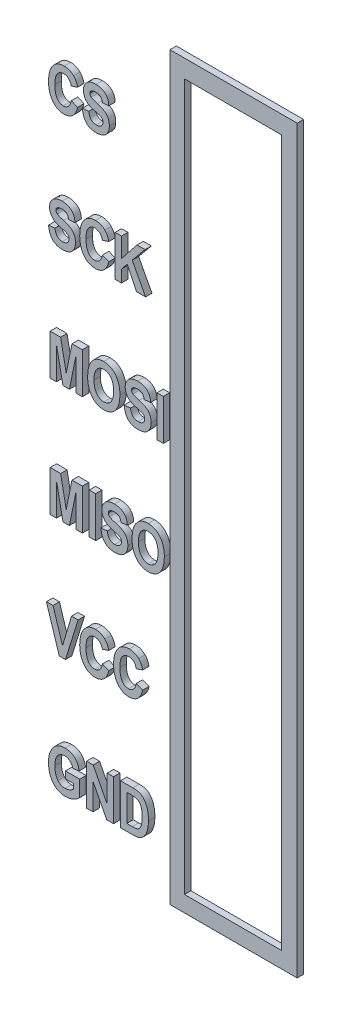
from build123d import *

# Parameters (mm, degrees)
ESQUISSE2_W                  = 5.5
ESQUISSE2_H                  = 16
ESQUISSE2_R                  = 0.5
BOSS_EXTRU_1_DEPTH           = 0.3
ESQUISSE3_W                  = 2.75
ESQUISSE3_H                  = 16
ESQUISSE3_W_2                = 2.093202219
ESQUISSE3_H_2                = 15.265940319
BOSS_EXTRU_2_DEPTH           = 0.15
ESQUISSE7_W                  = 3.771687216
ESQUISSE7_H                  = 16
BOSS_EXTRU_6_DEPTH           = 0.3
ESQUISSE8_W                  = 3.189954681
ESQUISSE8_H                  = 1.140545916
ENL_V_MAT_EXTRU_2_DEPTH      = 44.3
ESQUISSE9_W                  = 0.137142857
ESQUISSE9_H                  = 0.88
BOSS_EXTRU_7_DEPTH           = 0.15
ESQUISSE10_W                 = 1.381973647
ESQUISSE10_H                 = 14.642339828
BOSS_EXTRU_8_DEPTH           = 0.3
ENL_V_MAT_EXTRU_3_DEPTH      = 13
ENL_V_MAT_EXTRU_3_DEPTH_BACK = 23
ESQUISSE11_W                 = 6.728395809
ESQUISSE11_H                 = 0.64914079


with BuildPart() as part:
    # Esquisse2 → Boss.-Extru.1 (new body)
    with BuildSketch(Plane.XY):
        with Locations((-37.809161502, -23.96982377)):
            Rectangle(ESQUISSE2_W, ESQUISSE2_H)
        with Locations((-39.059161502, -30.31982377)):
            Circle(ESQUISSE2_R, mode=Mode.SUBTRACT)
        with Locations((-39.059161502, -27.77982377)):
            Circle(ESQUISSE2_R, mode=Mode.SUBTRACT)
        with Locations((-39.059161502, -25.23982377)):
            Circle(ESQUISSE2_R, mode=Mode.SUBTRACT)
        with Locations((-39.059161502, -22.69982377)):
            Circle(ESQUISSE2_R, mode=Mode.SUBTRACT)
        with Locations((-39.059161502, -20.15982377)):
            Circle(ESQUISSE2_R, mode=Mode.SUBTRACT)
        with Locations((-39.059161502, -17.61982377)):
            Circle(ESQUISSE2_R, mode=Mode.SUBTRACT)
    extrude(amount=BOSS_EXTRU_1_DEPTH)

    # Esquisse3 → Boss.-Extru.2 (add)
    with BuildSketch(Plane.XY.offset(0.3)):
        with Locations((-39.184161502, -23.96982377)):
            Rectangle(ESQUISSE3_W, ESQUISSE3_H)
        with Locations((-39.19830217, -23.991150858)):
            Rectangle(ESQUISSE3_W_2, ESQUISSE3_H_2, mode=Mode.SUBTRACT)
    extrude(amount=BOSS_EXTRU_2_DEPTH)

    # Esquisse7 → Boss.-Extru.6 (add)
    with BuildSketch(Plane.XY.offset(0.3)):
        with Locations((-42.44500511, -23.96982377)):
            Rectangle(ESQUISSE7_W, ESQUISSE7_H)
    extrude(amount=-BOSS_EXTRU_6_DEPTH)

    # Esquisse8 → Enlèv. mat.-Extru.2 (cut)
    with BuildSketch(Plane(origin=(0, 0, 0), x_dir=(1, 0, 0), z_dir=(0, 1, 0))):
        with Locations((-36.214184162, 0.270272958)):
            Rectangle(ESQUISSE8_W, ESQUISSE8_H)
    extrude(amount=-ENL_V_MAT_EXTRU_2_DEPTH, mode=Mode.SUBTRACT)

    # Esquisse9 → Boss.-Extru.7 (add)
    # profile 1 of 19: a face of its own
    with BuildSketch(Plane.XY.offset(0.3)):
        with BuildLine():
            Line((-42.691940203, -17.989477531), (-42.554797346, -18.046620388))
            add(Edge.make_bspline(
                [(-42.554797346, -18.046620388), (-42.557629737, -18.058148509), (-42.563148791, -18.080611621), (-42.57359008, -18.112717722), (-42.585079526, -18.142507294), (-42.598224097, -18.169813593), (-42.612573134, -18.194876187), (-42.628511995, -18.217448451), (-42.645740804, -18.237645957), (-42.664357556, -18.25542151), (-42.684332057, -18.270715953), (-42.705103475, -18.284344855), (-42.72720819, -18.295517651), (-42.750336676, -18.304951358), (-42.774670764, -18.311963752), (-42.80002557, -18.317240868), (-42.826509924, -18.32026068), (-42.844551857, -18.320688541), (-42.853725917, -18.320906102)],
                knots=[0, 0, 0, 0, 1.282586353, 2.499182829, 3.646034602, 4.730797578, 5.771318175, 6.763713287, 7.712684321, 8.6363956, 9.539720391, 10.428356747, 11.317388874, 12.212151588, 13.124116906, 14.050177375, 15.008543639, 16, 16, 16, 16], degree=3))
            add(Edge.make_bspline(
                [(-42.853725917, -18.320906102), (-42.865236569, -18.320647315), (-42.887785665, -18.320140356), (-42.920689129, -18.314685601), (-42.95199961, -18.306398052), (-42.981660668, -18.29449708), (-43.009707475, -18.279285104), (-43.035843741, -18.260442837), (-43.060679334, -18.238671744), (-43.07511952, -18.221696709), (-43.082475917, -18.21304896)],
                knots=[0, 0, 0, 0, 1.053414494, 2.063614103, 3.046293227, 4.01520277, 4.983805463, 5.961130836, 6.961320097, 8, 8, 8, 8], degree=3))
            add(Edge.make_bspline(
                [(-43.082475917, -18.21304896), (-43.090562076, -18.202372228), (-43.10685239, -18.180862965), (-43.127303975, -18.14539423), (-43.14469844, -18.107289034), (-43.158934952, -18.066512841), (-43.170031563, -18.023020476), (-43.177789535, -17.976791205), (-43.182448433, -17.927847387), (-43.183057343, -17.894309374), (-43.183368774, -17.877156102)],
                knots=[0, 0, 0, 0, 0.898140554, 1.809387162, 2.740718204, 3.705966939, 4.703925369, 5.74945803, 6.848943185, 8, 8, 8, 8], degree=3))
            add(Edge.make_bspline(
                [(-43.183368774, -17.877156102), (-43.183084259, -17.859048399), (-43.182530071, -17.823777632), (-43.177540451, -17.772426747), (-43.169933989, -17.724015084), (-43.158593069, -17.678722582), (-43.144386069, -17.636289167), (-43.126833362, -17.596979448), (-43.106452907, -17.560382306), (-43.089824785, -17.538525258), (-43.08158306, -17.527691817)],
                knots=[0, 0, 0, 0, 1.171098873, 2.281104103, 3.334483992, 4.338438261, 5.297974877, 6.225356982, 7.120398547, 8, 8, 8, 8], degree=3))
            add(Edge.make_bspline(
                [(-43.08158306, -17.527691817), (-43.074099981, -17.518934688), (-43.059352437, -17.501676265), (-43.034145376, -17.47932782), (-43.007065079, -17.460330845), (-42.978121343, -17.444777149), (-42.947184658, -17.432679992), (-42.914406434, -17.424144049), (-42.879655434, -17.419107501), (-42.855885479, -17.4184072), (-42.843725917, -17.41804896)],
                knots=[0, 0, 0, 0, 1.017460211, 2.005195831, 2.96880208, 3.936538458, 4.903086366, 5.898753713, 6.925103759, 8, 8, 8, 8], degree=3))
            add(Edge.make_bspline(
                [(-42.843725917, -17.41804896), (-42.833774959, -17.418287149), (-42.814216819, -17.418755299), (-42.785538352, -17.422497901), (-42.758215062, -17.429078743), (-42.731980233, -17.437710754), (-42.707064036, -17.449260296), (-42.683394424, -17.463274991), (-42.660878318, -17.479708764), (-42.647230949, -17.492484489), (-42.64033306, -17.498941817)],
                knots=[0, 0, 0, 0, 1.062174293, 2.087653736, 3.080296642, 4.058948008, 5.03139012, 6.005719887, 6.992016441, 8, 8, 8, 8], degree=3))
            add(Edge.make_bspline(
                [(-42.64033306, -17.498941817), (-42.635537025, -17.503918596), (-42.625764053, -17.514059872), (-42.612604725, -17.531142217), (-42.600421471, -17.549955111), (-42.589432723, -17.570578836), (-42.579216833, -17.59281182), (-42.56992735, -17.616768028), (-42.561755193, -17.642501958), (-42.557152458, -17.660346761), (-42.554797346, -17.669477531)],
                knots=[0, 0, 0, 0, 0.858002413, 1.748367619, 2.673305357, 3.63929672, 4.648357542, 5.711115493, 6.828831091, 8, 8, 8, 8], degree=3))
            Line((-42.554797346, -17.669477531), (-42.691940203, -17.715191817))
            add(Edge.make_bspline(
                [(-42.691940203, -17.715191817), (-42.693228927, -17.709338737), (-42.69573657, -17.697949617), (-42.700771279, -17.681513567), (-42.706900836, -17.666247743), (-42.713569875, -17.651785667), (-42.721600508, -17.63862756), (-42.730000803, -17.626144719), (-42.739850935, -17.615085406), (-42.750257326, -17.604868497), (-42.761587041, -17.596039395), (-42.773184022, -17.588054849), (-42.785394021, -17.581416285), (-42.798166105, -17.57607721), (-42.811349001, -17.571756284), (-42.825040942, -17.568717704), (-42.839210592, -17.566877642), (-42.848839348, -17.566706992), (-42.853725917, -17.566620388)],
                knots=[0, 0, 0, 0, 1.200071046, 2.335138942, 3.437621639, 4.493482591, 5.51985659, 6.521917265, 7.50210956, 8.480124453, 9.438987346, 10.374745328, 11.297656865, 12.216555725, 13.143999084, 14.072438006, 15.021767148, 16, 16, 16, 16], degree=3))
            add(Edge.make_bspline(
                [(-42.853725917, -17.566620388), (-42.860641625, -17.566825431), (-42.874252446, -17.567228977), (-42.894193471, -17.570439667), (-42.91306039, -17.576118484), (-42.931137251, -17.583573651), (-42.948120294, -17.593506154), (-42.964198581, -17.605534554), (-42.978939785, -17.62002236), (-42.993067673, -17.636318655), (-43.005869931, -17.65519996), (-43.016739922, -17.677021728), (-43.025705691, -17.701706056), (-43.033428644, -17.729075908), (-43.039206833, -17.759311108), (-43.043216718, -17.792364834), (-43.045719339, -17.828189153), (-43.046053174, -17.853044662), (-43.046225917, -17.865906102)],
                knots=[0, 0, 0, 0, 0.827686898, 1.628972485, 2.409099021, 3.181967192, 3.964173723, 4.757978677, 5.579415306, 6.433460257, 7.33665582, 8.302235029, 9.343905073, 10.476376866, 11.703364719, 13.024698166, 14.460435141, 16, 16, 16, 16], degree=3))
            add(Edge.make_bspline(
                [(-43.046225917, -17.865906102), (-43.046030727, -17.879241898), (-43.045654849, -17.904922601), (-43.043463784, -17.942014144), (-43.039299089, -17.976092777), (-43.033967963, -18.007292498), (-43.026672817, -18.035430944), (-43.017760387, -18.060525347), (-43.007494685, -18.082820696), (-42.995248804, -18.102024472), (-42.981680125, -18.118603048), (-42.967254139, -18.132996863), (-42.951692334, -18.145020894), (-42.93541103, -18.15521119), (-42.91796324, -18.162933127), (-42.899555378, -18.168186959), (-42.880296615, -18.17182078), (-42.867076679, -18.172161082), (-42.86033306, -18.172334674)],
                knots=[0, 0, 0, 0, 1.588381619, 3.058741945, 4.422565575, 5.675514383, 6.825848758, 7.879737597, 8.8437938, 9.742560847, 10.584031071, 11.391113559, 12.163968987, 12.921455088, 13.673648094, 14.427376256, 15.197789283, 16, 16, 16, 16], degree=3))
            add(Edge.make_bspline(
                [(-42.86033306, -18.172334674), (-42.855387185, -18.172181497), (-42.845575954, -18.171877638), (-42.831138643, -18.169942748), (-42.81720688, -18.166483201), (-42.803778787, -18.161683472), (-42.790911592, -18.155350843), (-42.778473279, -18.147848516), (-42.766715118, -18.138830638), (-42.755332011, -18.128591281), (-42.744595687, -18.11681421), (-42.734783508, -18.103273896), (-42.725666884, -18.088212339), (-42.717300931, -18.071536128), (-42.709632292, -18.053352446), (-42.702870806, -18.033521754), (-42.69675229, -18.012143057), (-42.693575128, -17.99717823), (-42.691940203, -17.989477531)],
                knots=[0, 0, 0, 0, 0.874040642, 1.73385169, 2.568061146, 3.406503852, 4.248567505, 5.09821747, 5.96915136, 6.862782357, 7.800986125, 8.779254107, 9.812897901, 10.908933612, 12.073249979, 13.297367906, 14.609261928, 16, 16, 16, 16], degree=3))
        make_face()
    # profile 2 of 19: a face of its own
    with BuildSketch(Plane.XY.offset(0.3)):
        with BuildLine():
            Line((-42.451940203, -18.012334674), (-42.314797346, -18.000906102))
            add(Edge.make_bspline(
                [(-42.314797346, -18.000906102), (-42.313691116, -18.007827213), (-42.311533929, -18.021323632), (-42.306988159, -18.04072663), (-42.301936974, -18.058937002), (-42.295613343, -18.075642045), (-42.288723856, -18.091208144), (-42.280646496, -18.1052398), (-42.271885853, -18.11813775), (-42.262060153, -18.129514622), (-42.251423612, -18.13963606), (-42.239982863, -18.148467809), (-42.227521648, -18.155786594), (-42.214276045, -18.161940398), (-42.200040935, -18.166520817), (-42.184994897, -18.169961231), (-42.169014176, -18.171896942), (-42.158076126, -18.172186448), (-42.152475917, -18.172334674)],
                knots=[0, 0, 0, 0, 1.283284002, 2.502450598, 3.648036641, 4.741550817, 5.771019705, 6.762197452, 7.702675527, 8.622646947, 9.509464764, 10.388204522, 11.263216913, 12.15103932, 13.057737472, 13.996634539, 14.974290105, 16, 16, 16, 16], degree=3))
            add(Edge.make_bspline(
                [(-42.152475917, -18.172334674), (-42.146935965, -18.172237536), (-42.136129302, -18.17204805), (-42.120430078, -18.170415012), (-42.105590116, -18.167791274), (-42.091757145, -18.163837576), (-42.07872744, -18.158972704), (-42.066520929, -18.153196366), (-42.055469481, -18.145904005), (-42.045210836, -18.137938058), (-42.036195523, -18.128947632), (-42.028046974, -18.119587239), (-42.021450304, -18.109407368), (-42.015832652, -18.098875541), (-42.011550687, -18.087772033), (-42.008531678, -18.076147424), (-42.006434617, -18.064077132), (-42.006295877, -18.055796084), (-42.006225917, -18.051620388)],
                knots=[0, 0, 0, 0, 1.24984806, 2.438050946, 3.557771333, 4.64636299, 5.679248938, 6.694516573, 7.68559378, 8.661074055, 9.620421872, 10.554324834, 11.455887309, 12.351123657, 13.244140324, 14.133614264, 15.058880124, 16, 16, 16, 16], degree=3))
            add(Edge.make_bspline(
                [(-42.006225917, -18.051620388), (-42.006389198, -18.046786617), (-42.006706367, -18.037397166), (-42.00940382, -18.023820858), (-42.014050849, -18.011390622), (-42.020657308, -18.000110369), (-42.028932181, -17.989846347), (-42.039166223, -17.980570226), (-42.051400552, -17.972452237), (-42.063175555, -17.966338394), (-42.074388252, -17.961402694), (-42.085388673, -17.957441192), (-42.098518706, -17.952500151), (-42.114148485, -17.94746868), (-42.131914676, -17.941544076), (-42.151990332, -17.935028946), (-42.17451108, -17.928383585), (-42.190277035, -17.923596057), (-42.198547346, -17.921084674)],
                knots=[0, 0, 0, 0, 0.920834509, 1.788692479, 2.625355144, 3.438845263, 4.269949672, 5.129384894, 6.060923099, 7.060788299, 7.655274663, 8.394990962, 9.288793567, 10.329357386, 11.524217089, 12.85908646, 14.352378214, 16, 16, 16, 16], degree=3))
            add(Edge.make_bspline(
                [(-42.198547346, -17.921084674), (-42.206065237, -17.918817893), (-42.220630844, -17.914426097), (-42.241521329, -17.907143881), (-42.261015481, -17.900237667), (-42.278701213, -17.892547311), (-42.295080824, -17.885172335), (-42.309769433, -17.877348483), (-42.322964254, -17.869450726), (-42.338471276, -17.858774675), (-42.355746243, -17.84377851), (-42.374101255, -17.823408826), (-42.390233214, -17.800545878), (-42.404107919, -17.77542104), (-42.415360565, -17.74851122), (-42.423144209, -17.720173958), (-42.428194224, -17.690967601), (-42.428784998, -17.671105606), (-42.42908306, -17.661084674)],
                knots=[0, 0, 0, 0, 0.995705067, 1.929137906, 2.805643294, 3.617475646, 4.374079425, 5.083250302, 5.726695175, 6.323501674, 7.469021963, 8.618192986, 9.793256335, 11.00968795, 12.251802723, 13.482671819, 14.729937436, 16, 16, 16, 16], degree=3))
            add(Edge.make_bspline(
                [(-42.42908306, -17.661084674), (-42.428678333, -17.649506823), (-42.427883604, -17.626772344), (-42.421394546, -17.593574876), (-42.411096495, -17.562119447), (-42.396541363, -17.532762052), (-42.378457224, -17.505972394), (-42.356815997, -17.482519823), (-42.332000079, -17.462635295), (-42.303999975, -17.446217221), (-42.272578595, -17.433540142), (-42.237826825, -17.424556106), (-42.199742611, -17.418918199), (-42.173211078, -17.418345969), (-42.159440203, -17.41804896)],
                knots=[0, 0, 0, 0, 1.016001525, 1.995039112, 2.958718515, 3.914826359, 4.86299968, 5.787773554, 6.706158304, 7.645676028, 8.628001228, 9.67146541, 10.791401858, 12, 12, 12, 12], degree=3))
            add(Edge.make_bspline(
                [(-42.159440203, -17.41804896), (-42.14895598, -17.418247286), (-42.128471849, -17.418634777), (-42.098664565, -17.421859688), (-42.070669669, -17.427236772), (-42.044366796, -17.43448769), (-42.019861979, -17.444090152), (-41.997228771, -17.456059519), (-41.976104768, -17.469691628), (-41.957244538, -17.485985282), (-41.939925245, -17.503808417), (-41.924874225, -17.52372017), (-41.912189833, -17.545563896), (-41.901411448, -17.569041709), (-41.892823558, -17.59441775), (-41.886481026, -17.62163217), (-41.882125402, -17.650660885), (-41.881058704, -17.6706529), (-41.880511631, -17.680906102)],
                knots=[0, 0, 0, 0, 1.161082811, 2.268529788, 3.315920136, 4.315767948, 5.286675817, 6.224491986, 7.147968113, 8.064782936, 8.978748437, 9.896534752, 10.821515985, 11.771513441, 12.753550833, 13.783446476, 14.863207619, 16, 16, 16, 16], degree=3))
            Line((-41.880511631, -17.680906102), (-42.017654488, -17.692334674))
            add(Edge.make_bspline(
                [(-42.017654488, -17.692334674), (-42.018619485, -17.686731126), (-42.020486283, -17.675890989), (-42.023965291, -17.660269801), (-42.028441405, -17.646019953), (-42.03357177, -17.632996546), (-42.039669576, -17.621458735), (-42.046270372, -17.611053512), (-42.053829251, -17.602105367), (-42.064875824, -17.591714031), (-42.081444391, -17.581361795), (-42.104488766, -17.572655681), (-42.131124955, -17.567546646), (-42.150012195, -17.566940273), (-42.159975917, -17.566620388)],
                knots=[0, 0, 0, 0, 0.959243267, 1.855668837, 2.69732651, 3.476781153, 4.213401683, 4.895802106, 5.551525866, 6.183841498, 7.448472762, 8.815414589, 10.320012641, 12, 12, 12, 12], degree=3))
            add(Edge.make_bspline(
                [(-42.159975917, -17.566620388), (-42.169936104, -17.566844738), (-42.18877934, -17.567269176), (-42.215290269, -17.571720779), (-42.238343536, -17.579013208), (-42.257459475, -17.589635112), (-42.27269763, -17.602286268), (-42.283882988, -17.61671364), (-42.290756445, -17.632958167), (-42.291543336, -17.644414059), (-42.291940203, -17.650191817)],
                knots=[0, 0, 0, 0, 1.375503163, 2.602253489, 3.70275074, 4.700811603, 5.605681669, 6.421826054, 7.204050882, 8, 8, 8, 8], degree=3))
            add(Edge.make_bspline(
                [(-42.291940203, -17.650191817), (-42.291555342, -17.655836583), (-42.290798735, -17.666933777), (-42.284925814, -17.682837086), (-42.275253102, -17.697301425), (-42.266369944, -17.705083357), (-42.261761631, -17.709120388)],
                knots=[0, 0, 0, 0, 0.986511101, 1.93940795, 2.931027269, 4, 4, 4, 4], degree=3))
            add(Edge.make_bspline(
                [(-42.261761631, -17.709120388), (-42.258947326, -17.711210956), (-42.252726632, -17.715831913), (-42.241520103, -17.721792162), (-42.228363751, -17.72854844), (-42.21267174, -17.734972045), (-42.194941626, -17.74200841), (-42.174739062, -17.748888622), (-42.152376378, -17.756216231), (-42.136594598, -17.760942607), (-42.128368774, -17.763406102)],
                knots=[0, 0, 0, 0, 0.580970997, 1.284168869, 2.101321398, 3.035084219, 4.095219995, 5.266568887, 6.575273271, 8, 8, 8, 8], degree=3))
            add(Edge.make_bspline(
                [(-42.128368774, -17.763406102), (-42.119538243, -17.766079703), (-42.102455272, -17.771251876), (-42.078018287, -17.779804509), (-42.055290969, -17.787861008), (-42.034548037, -17.796240444), (-42.015765062, -17.804852181), (-41.998769718, -17.813397295), (-41.983583131, -17.82189818), (-41.965976204, -17.833238291), (-41.94665109, -17.849012236), (-41.925981526, -17.87004277), (-41.908870027, -17.894212242), (-41.894158399, -17.920556284), (-41.882971888, -17.949871656), (-41.874730787, -17.98183415), (-41.869928667, -18.016773027), (-41.869371914, -18.041010028), (-41.86908306, -18.053584674)],
                knots=[0, 0, 0, 0, 1.035756796, 2.003707701, 2.906407247, 3.742850513, 4.51441117, 5.225734541, 5.878106001, 6.467575161, 7.574958109, 8.671458568, 9.767653495, 10.889322485, 12.050953544, 13.27960766, 14.588605383, 16, 16, 16, 16], degree=3))
            add(Edge.make_bspline(
                [(-41.86908306, -18.053584674), (-41.869259171, -18.062823505), (-41.86960582, -18.08100875), (-41.873229474, -18.107679358), (-41.878396061, -18.133319689), (-41.886198157, -18.157827402), (-41.896165937, -18.181126508), (-41.908266817, -18.203394742), (-41.922578252, -18.224430653), (-41.938961776, -18.244334534), (-41.957734454, -18.262518419), (-41.979131072, -18.278260174), (-42.002974446, -18.29164284), (-42.029383646, -18.302220645), (-42.058151055, -18.310627171), (-42.089349705, -18.316652021), (-42.123048546, -18.32019873), (-42.146336196, -18.320665121), (-42.158368774, -18.320906102)],
                knots=[0, 0, 0, 0, 0.991804927, 1.952218352, 2.886457782, 3.798464992, 4.709395717, 5.604960052, 6.516496456, 7.438312874, 8.369857157, 9.316183769, 10.2837644, 11.298954172, 12.365211701, 13.498800204, 14.707646267, 16, 16, 16, 16], degree=3))
            add(Edge.make_bspline(
                [(-42.158368774, -18.320906102), (-42.169092563, -18.320662854), (-42.189947399, -18.320189803), (-42.220323893, -18.316616376), (-42.248819256, -18.310518772), (-42.27558585, -18.302247192), (-42.300409637, -18.291166119), (-42.323598445, -18.278034943), (-42.344764779, -18.262185459), (-42.364062944, -18.243925628), (-42.381562091, -18.223305377), (-42.397410674, -18.200331217), (-42.411060583, -18.174792529), (-42.423140165, -18.147000675), (-42.432944069, -18.116673367), (-42.441438282, -18.084095635), (-42.447803639, -18.049042919), (-42.450536166, -18.024794225), (-42.451940203, -18.012334674)],
                knots=[0, 0, 0, 0, 1.077126704, 2.094716892, 3.06695406, 4.001175917, 4.903369973, 5.792630967, 6.672819179, 7.55264172, 8.45610307, 9.384912885, 10.350803934, 11.360510561, 12.42508299, 13.549057315, 14.740647766, 16, 16, 16, 16], degree=3))
        make_face()
    # profile 3 of 19: a face of its own
    with BuildSketch(Plane.XY.offset(0.3)):
        with BuildLine():
            Line((-43.183368774, -20.563763245), (-43.046225917, -20.552334674))
            add(Edge.make_bspline(
                [(-43.046225917, -20.552334674), (-43.045119688, -20.559255785), (-43.042962501, -20.572752203), (-43.03841673, -20.592155202), (-43.033365545, -20.610365574), (-43.027041914, -20.627070617), (-43.020152427, -20.642636715), (-43.012075067, -20.656668371), (-43.003314424, -20.669566321), (-42.993488725, -20.680943193), (-42.982852183, -20.691064631), (-42.971411435, -20.69989638), (-42.958950219, -20.707215165), (-42.945704616, -20.713368969), (-42.931469506, -20.717949388), (-42.916423468, -20.721389802), (-42.900442747, -20.723325513), (-42.889504698, -20.72361502), (-42.883904488, -20.723763245)],
                knots=[0, 0, 0, 0, 1.283284002, 2.502450598, 3.648036641, 4.741550817, 5.771019705, 6.762197452, 7.702675527, 8.622646947, 9.509464764, 10.388204522, 11.263216913, 12.15103932, 13.057737472, 13.996634539, 14.974290105, 16, 16, 16, 16], degree=3))
            add(Edge.make_bspline(
                [(-42.883904488, -20.723763245), (-42.878364536, -20.723666107), (-42.867557873, -20.723476621), (-42.851858649, -20.721843583), (-42.837018687, -20.719219845), (-42.823185716, -20.715266147), (-42.810156011, -20.710401275), (-42.7979495, -20.704624937), (-42.786898053, -20.697332577), (-42.776639407, -20.689366629), (-42.767624095, -20.680376203), (-42.759475545, -20.671015811), (-42.752878875, -20.66083594), (-42.747261223, -20.650304113), (-42.742979259, -20.639200604), (-42.739960249, -20.627575995), (-42.737863189, -20.615505704), (-42.737724448, -20.607224655), (-42.737654488, -20.60304896)],
                knots=[0, 0, 0, 0, 1.24984806, 2.438050946, 3.557771333, 4.64636299, 5.679248938, 6.694516573, 7.68559378, 8.661074055, 9.620421872, 10.554324834, 11.455887309, 12.351123657, 13.244140324, 14.133614264, 15.058880124, 16, 16, 16, 16], degree=3))
            add(Edge.make_bspline(
                [(-42.737654488, -20.60304896), (-42.73781777, -20.598215188), (-42.738134938, -20.588825737), (-42.740832391, -20.575249429), (-42.74547942, -20.562819193), (-42.75208588, -20.551538941), (-42.760360753, -20.541274918), (-42.770594794, -20.531998798), (-42.782829123, -20.523880808), (-42.794604127, -20.517766965), (-42.805816824, -20.512831265), (-42.816817245, -20.508869764), (-42.829947277, -20.503928722), (-42.845577057, -20.498897251), (-42.863343247, -20.492972648), (-42.883418903, -20.486457517), (-42.905939652, -20.479812156), (-42.921705606, -20.475024628), (-42.929975917, -20.472513245)],
                knots=[0, 0, 0, 0, 0.920834509, 1.788692479, 2.625355144, 3.438845263, 4.269949672, 5.129384894, 6.060923099, 7.060788299, 7.655274663, 8.394990962, 9.288793567, 10.329357386, 11.524217089, 12.85908646, 14.352378214, 16, 16, 16, 16], degree=3))
            add(Edge.make_bspline(
                [(-42.929975917, -20.472513245), (-42.937493808, -20.470246464), (-42.952059415, -20.465854668), (-42.972949901, -20.458572452), (-42.992444052, -20.451666239), (-43.010129784, -20.443975883), (-43.026509396, -20.436600906), (-43.041198005, -20.428777055), (-43.054392825, -20.420879297), (-43.069899847, -20.410203247), (-43.087174815, -20.395207082), (-43.105529827, -20.374837397), (-43.121661785, -20.351974449), (-43.13553649, -20.326849611), (-43.146789136, -20.299939792), (-43.154572781, -20.27160253), (-43.159622795, -20.242396173), (-43.160213569, -20.222534178), (-43.160511631, -20.212513245)],
                knots=[0, 0, 0, 0, 0.995705067, 1.929137906, 2.805643294, 3.617475646, 4.374079425, 5.083250302, 5.726695175, 6.323501674, 7.469021963, 8.618192986, 9.793256335, 11.00968795, 12.251802723, 13.482671819, 14.729937436, 16, 16, 16, 16], degree=3))
            add(Edge.make_bspline(
                [(-43.160511631, -20.212513245), (-43.160106905, -20.200935394), (-43.159312176, -20.178200915), (-43.152823117, -20.145003447), (-43.142525067, -20.113548018), (-43.127969934, -20.084190624), (-43.109885795, -20.057400966), (-43.088244568, -20.033948395), (-43.06342865, -20.014063866), (-43.035428547, -19.997645792), (-43.004007166, -19.984968713), (-42.969255396, -19.975984677), (-42.931171182, -19.97034677), (-42.90463965, -19.96977454), (-42.890868774, -19.969477531)],
                knots=[0, 0, 0, 0, 1.016001525, 1.995039112, 2.958718515, 3.914826359, 4.86299968, 5.787773554, 6.706158304, 7.645676028, 8.628001228, 9.67146541, 10.791401858, 12, 12, 12, 12], degree=3))
            add(Edge.make_bspline(
                [(-42.890868774, -19.969477531), (-42.880384551, -19.969675857), (-42.85990042, -19.970063349), (-42.830093137, -19.973288259), (-42.802098241, -19.978665344), (-42.775795368, -19.985916262), (-42.75129055, -19.995518723), (-42.728657342, -20.00748809), (-42.707533339, -20.021120199), (-42.68867311, -20.037413853), (-42.671353817, -20.055236988), (-42.656302796, -20.075148741), (-42.643618404, -20.096992467), (-42.63284002, -20.120470281), (-42.62425213, -20.145846321), (-42.617909597, -20.173060742), (-42.613553974, -20.202089456), (-42.612487275, -20.222081472), (-42.611940203, -20.232334674)],
                knots=[0, 0, 0, 0, 1.161082811, 2.268529788, 3.315920136, 4.315767948, 5.286675817, 6.224491986, 7.147968113, 8.064782936, 8.978748437, 9.896534752, 10.821515985, 11.771513441, 12.753550833, 13.783446476, 14.863207619, 16, 16, 16, 16], degree=3))
            Line((-42.611940203, -20.232334674), (-42.74908306, -20.243763245))
            add(Edge.make_bspline(
                [(-42.74908306, -20.243763245), (-42.750048056, -20.238159698), (-42.751914855, -20.22731956), (-42.755393863, -20.211698372), (-42.759869976, -20.197448525), (-42.765000342, -20.184425117), (-42.771098147, -20.172887307), (-42.777698943, -20.162482084), (-42.785257822, -20.153533938), (-42.796304395, -20.143142602), (-42.812872962, -20.132790367), (-42.835917338, -20.124084252), (-42.862553526, -20.118975218), (-42.881440766, -20.118368844), (-42.891404488, -20.11804896)],
                knots=[0, 0, 0, 0, 0.959243267, 1.855668837, 2.69732651, 3.476781153, 4.213401683, 4.895802106, 5.551525866, 6.183841498, 7.448472762, 8.815414589, 10.320012641, 12, 12, 12, 12], degree=3))
            add(Edge.make_bspline(
                [(-42.891404488, -20.11804896), (-42.901364675, -20.118273309), (-42.920207911, -20.118697747), (-42.94671884, -20.12314935), (-42.969772107, -20.130441779), (-42.988888046, -20.141063684), (-43.004126202, -20.153714839), (-43.015311559, -20.168142212), (-43.022185017, -20.184386738), (-43.022971907, -20.19584263), (-43.023368774, -20.201620388)],
                knots=[0, 0, 0, 0, 1.375503163, 2.602253489, 3.70275074, 4.700811603, 5.605681669, 6.421826054, 7.204050882, 8, 8, 8, 8], degree=3))
            add(Edge.make_bspline(
                [(-43.023368774, -20.201620388), (-43.022983914, -20.207265155), (-43.022227307, -20.218362348), (-43.016354386, -20.234265657), (-43.006681674, -20.248729996), (-42.997798516, -20.256511929), (-42.993190203, -20.26054896)],
                knots=[0, 0, 0, 0, 0.986511101, 1.93940795, 2.931027269, 4, 4, 4, 4], degree=3))
            add(Edge.make_bspline(
                [(-42.993190203, -20.26054896), (-42.990375898, -20.262639527), (-42.984155203, -20.267260485), (-42.972948675, -20.273220733), (-42.959792322, -20.279977011), (-42.944100311, -20.286400616), (-42.926370197, -20.293436981), (-42.906167634, -20.300317193), (-42.883804949, -20.307644802), (-42.86802317, -20.312371179), (-42.859797346, -20.314834674)],
                knots=[0, 0, 0, 0, 0.580970997, 1.284168869, 2.101321398, 3.035084219, 4.095219995, 5.266568887, 6.575273271, 8, 8, 8, 8], degree=3))
            add(Edge.make_bspline(
                [(-42.859797346, -20.314834674), (-42.850966814, -20.317508274), (-42.833883843, -20.322680448), (-42.809446858, -20.33123308), (-42.786719541, -20.33928958), (-42.765976609, -20.347669016), (-42.747193634, -20.356280752), (-42.73019829, -20.364825866), (-42.715011702, -20.373326751), (-42.697404776, -20.384666862), (-42.678079662, -20.400440807), (-42.657410097, -20.421471342), (-42.640298599, -20.445640813), (-42.625586971, -20.471984855), (-42.614400459, -20.501300228), (-42.606159358, -20.533262721), (-42.601357238, -20.568201599), (-42.600800486, -20.592438599), (-42.600511631, -20.605013245)],
                knots=[0, 0, 0, 0, 1.035756796, 2.003707701, 2.906407247, 3.742850513, 4.51441117, 5.225734541, 5.878106001, 6.467575161, 7.574958109, 8.671458568, 9.767653495, 10.889322485, 12.050953544, 13.27960766, 14.588605383, 16, 16, 16, 16], degree=3))
            add(Edge.make_bspline(
                [(-42.600511631, -20.605013245), (-42.600687743, -20.614252076), (-42.601034392, -20.632437321), (-42.604658046, -20.65910793), (-42.609824632, -20.68474826), (-42.617626729, -20.709255974), (-42.627594509, -20.732555079), (-42.639695389, -20.754823313), (-42.654006823, -20.775859225), (-42.670390348, -20.795763105), (-42.689163025, -20.813946991), (-42.710559643, -20.829688745), (-42.734403017, -20.843071412), (-42.760812217, -20.853649216), (-42.789579626, -20.862055743), (-42.820778277, -20.868080592), (-42.854477117, -20.871627301), (-42.877764768, -20.872093693), (-42.889797346, -20.872334674)],
                knots=[0, 0, 0, 0, 0.991804927, 1.952218352, 2.886457782, 3.798464992, 4.709395717, 5.604960052, 6.516496456, 7.438312874, 8.369857157, 9.316183769, 10.2837644, 11.298954172, 12.365211701, 13.498800204, 14.707646267, 16, 16, 16, 16], degree=3))
            add(Edge.make_bspline(
                [(-42.889797346, -20.872334674), (-42.900521134, -20.872091426), (-42.92137597, -20.871618374), (-42.951752465, -20.868044947), (-42.980247828, -20.861947344), (-43.007014421, -20.853675763), (-43.031838208, -20.842594691), (-43.055027016, -20.829463514), (-43.076193351, -20.813614031), (-43.095491516, -20.7953542), (-43.112990662, -20.774733949), (-43.128839245, -20.751759789), (-43.142489154, -20.7262211), (-43.154568736, -20.698429246), (-43.16437264, -20.668101938), (-43.172866854, -20.635524207), (-43.179232211, -20.60047149), (-43.181964737, -20.576222797), (-43.183368774, -20.563763245)],
                knots=[0, 0, 0, 0, 1.077126704, 2.094716892, 3.06695406, 4.001175917, 4.903369973, 5.792630967, 6.672819179, 7.55264172, 8.45610307, 9.384912885, 10.350803934, 11.360510561, 12.42508299, 13.549057315, 14.740647766, 16, 16, 16, 16], degree=3))
        make_face()
    # profile 4 of 19: a face of its own
    with BuildSketch(Plane.XY.offset(0.3)):
        with BuildLine():
            Line((-42.017654488, -20.540906102), (-41.880511631, -20.59804896))
            add(Edge.make_bspline(
                [(-41.880511631, -20.59804896), (-41.883344022, -20.60957708), (-41.888863076, -20.632040193), (-41.899304366, -20.664146294), (-41.910793812, -20.693935865), (-41.923938383, -20.721242165), (-41.93828742, -20.746304759), (-41.954226281, -20.768877023), (-41.97145509, -20.789074528), (-41.990071841, -20.806850081), (-42.010046343, -20.822144525), (-42.030817761, -20.835773426), (-42.052922476, -20.846946222), (-42.076050961, -20.85637993), (-42.10038505, -20.863392323), (-42.125739856, -20.868669439), (-42.15222421, -20.871689252), (-42.170266143, -20.872117113), (-42.179440203, -20.872334674)],
                knots=[0, 0, 0, 0, 1.282586353, 2.499182829, 3.646034602, 4.730797578, 5.771318175, 6.763713287, 7.712684321, 8.6363956, 9.539720391, 10.428356747, 11.317388874, 12.212151588, 13.124116906, 14.050177375, 15.008543639, 16, 16, 16, 16], degree=3))
            add(Edge.make_bspline(
                [(-42.179440203, -20.872334674), (-42.190950855, -20.872075886), (-42.213499951, -20.871568927), (-42.246403415, -20.866114173), (-42.277713896, -20.857826624), (-42.307374954, -20.845925652), (-42.335421761, -20.830713675), (-42.361558027, -20.811871408), (-42.386393619, -20.790100316), (-42.400833806, -20.77312528), (-42.408190203, -20.764477531)],
                knots=[0, 0, 0, 0, 1.053414494, 2.063614103, 3.046293227, 4.01520277, 4.983805463, 5.961130836, 6.961320097, 8, 8, 8, 8], degree=3))
            add(Edge.make_bspline(
                [(-42.408190203, -20.764477531), (-42.416276361, -20.753800799), (-42.432566675, -20.732291537), (-42.45301826, -20.696822801), (-42.470412726, -20.658717605), (-42.484649238, -20.617941413), (-42.495745849, -20.574449048), (-42.503503821, -20.528219776), (-42.508162719, -20.479275958), (-42.508771629, -20.445737946), (-42.50908306, -20.428584674)],
                knots=[0, 0, 0, 0, 0.898140554, 1.809387162, 2.740718204, 3.705966939, 4.703925369, 5.74945803, 6.848943185, 8, 8, 8, 8], degree=3))
            add(Edge.make_bspline(
                [(-42.50908306, -20.428584674), (-42.508798545, -20.410476971), (-42.508244357, -20.375206203), (-42.503254737, -20.323855319), (-42.495648275, -20.275443656), (-42.484307355, -20.230151154), (-42.470100355, -20.187717738), (-42.452547647, -20.148408019), (-42.432167192, -20.111810877), (-42.415539071, -20.08995383), (-42.407297346, -20.079120388)],
                knots=[0, 0, 0, 0, 1.171098873, 2.281104103, 3.334483992, 4.338438261, 5.297974877, 6.225356982, 7.120398547, 8, 8, 8, 8], degree=3))
            add(Edge.make_bspline(
                [(-42.407297346, -20.079120388), (-42.399814266, -20.070363259), (-42.385066722, -20.053104836), (-42.359859662, -20.030756391), (-42.332779364, -20.011759417), (-42.303835629, -19.99620572), (-42.272898944, -19.984108563), (-42.24012072, -19.97557262), (-42.205369719, -19.970536072), (-42.181599765, -19.969835771), (-42.169440203, -19.969477531)],
                knots=[0, 0, 0, 0, 1.017460211, 2.005195831, 2.96880208, 3.936538458, 4.903086366, 5.898753713, 6.925103759, 8, 8, 8, 8], degree=3))
            add(Edge.make_bspline(
                [(-42.169440203, -19.969477531), (-42.159489245, -19.96971572), (-42.139931104, -19.97018387), (-42.111252638, -19.973926472), (-42.083929348, -19.980507314), (-42.057694518, -19.989139325), (-42.032778321, -20.000688867), (-42.00910871, -20.014703563), (-41.986592603, -20.031137335), (-41.972945235, -20.04391306), (-41.966047346, -20.050370388)],
                knots=[0, 0, 0, 0, 1.062174293, 2.087653736, 3.080296642, 4.058948008, 5.03139012, 6.005719887, 6.992016441, 8, 8, 8, 8], degree=3))
            add(Edge.make_bspline(
                [(-41.966047346, -20.050370388), (-41.96125131, -20.055347167), (-41.951478339, -20.065488443), (-41.938319011, -20.082570789), (-41.926135757, -20.101383682), (-41.915147009, -20.122007408), (-41.904931119, -20.144240392), (-41.895641635, -20.168196599), (-41.887469478, -20.19393053), (-41.882866744, -20.211775332), (-41.880511631, -20.220906102)],
                knots=[0, 0, 0, 0, 0.858002413, 1.748367619, 2.673305357, 3.63929672, 4.648357542, 5.711115493, 6.828831091, 8, 8, 8, 8], degree=3))
            Line((-41.880511631, -20.220906102), (-42.017654488, -20.266620388))
            add(Edge.make_bspline(
                [(-42.017654488, -20.266620388), (-42.018943213, -20.260767309), (-42.021450855, -20.249378189), (-42.026485565, -20.232942139), (-42.032615122, -20.217676314), (-42.039284161, -20.203214238), (-42.047314794, -20.190056131), (-42.055715088, -20.17757329), (-42.06556522, -20.166513977), (-42.075971612, -20.156297069), (-42.087301327, -20.147467966), (-42.098898308, -20.139483421), (-42.111108306, -20.132844856), (-42.123880391, -20.127505781), (-42.137063287, -20.123184856), (-42.150755227, -20.120146275), (-42.164924878, -20.118306214), (-42.174553634, -20.118135564), (-42.179440203, -20.11804896)],
                knots=[0, 0, 0, 0, 1.200071046, 2.335138942, 3.437621639, 4.493482591, 5.51985659, 6.521917265, 7.50210956, 8.480124453, 9.438987346, 10.374745328, 11.297656865, 12.216555725, 13.143999084, 14.072438006, 15.021767148, 16, 16, 16, 16], degree=3))
            add(Edge.make_bspline(
                [(-42.179440203, -20.11804896), (-42.186355911, -20.118254003), (-42.199966732, -20.118657548), (-42.219907757, -20.121868239), (-42.238774676, -20.127547055), (-42.256851536, -20.135002222), (-42.27383458, -20.144934725), (-42.289912867, -20.156963126), (-42.304654071, -20.171450931), (-42.318781959, -20.187747226), (-42.331584217, -20.206628532), (-42.342454207, -20.2284503), (-42.351419977, -20.253134627), (-42.359142929, -20.280504479), (-42.364921118, -20.31073968), (-42.368931004, -20.343793406), (-42.371433624, -20.379617725), (-42.37176746, -20.404473233), (-42.371940203, -20.417334674)],
                knots=[0, 0, 0, 0, 0.827686898, 1.628972485, 2.409099021, 3.181967192, 3.964173723, 4.757978677, 5.579415306, 6.433460257, 7.33665582, 8.302235029, 9.343905073, 10.476376866, 11.703364719, 13.024698166, 14.460435141, 16, 16, 16, 16], degree=3))
            add(Edge.make_bspline(
                [(-42.371940203, -20.417334674), (-42.371745012, -20.430670469), (-42.371369134, -20.456351172), (-42.369178069, -20.493442716), (-42.365013374, -20.527521348), (-42.359682249, -20.55872107), (-42.352387102, -20.586859515), (-42.343474673, -20.611953918), (-42.333208971, -20.634249267), (-42.32096309, -20.653453043), (-42.307394411, -20.670031619), (-42.292968425, -20.684425435), (-42.27740662, -20.696449465), (-42.261125316, -20.706639762), (-42.243677526, -20.714361698), (-42.225269664, -20.719615531), (-42.206010901, -20.723249352), (-42.192790964, -20.723589654), (-42.186047346, -20.723763245)],
                knots=[0, 0, 0, 0, 1.588381619, 3.058741945, 4.422565575, 5.675514383, 6.825848758, 7.879737597, 8.8437938, 9.742560847, 10.584031071, 11.391113559, 12.163968987, 12.921455088, 13.673648094, 14.427376256, 15.197789283, 16, 16, 16, 16], degree=3))
            add(Edge.make_bspline(
                [(-42.186047346, -20.723763245), (-42.18110147, -20.723610069), (-42.17129024, -20.723306209), (-42.156852929, -20.721371319), (-42.142921166, -20.717911772), (-42.129493072, -20.713112043), (-42.116625878, -20.706779414), (-42.104187565, -20.699277088), (-42.092429403, -20.69025921), (-42.081046296, -20.680019852), (-42.070309973, -20.668242782), (-42.060497794, -20.654702468), (-42.05138117, -20.63964091), (-42.043015217, -20.6229647), (-42.035346577, -20.604781018), (-42.028585092, -20.584950326), (-42.022466575, -20.563571629), (-42.019289413, -20.548606801), (-42.017654488, -20.540906102)],
                knots=[0, 0, 0, 0, 0.874040642, 1.73385169, 2.568061146, 3.406503852, 4.248567505, 5.09821747, 5.96915136, 6.862782357, 7.800986125, 8.779254107, 9.812897901, 10.908933612, 12.073249979, 13.297367906, 14.609261928, 16, 16, 16, 16], degree=3))
        make_face()
    # profile 5 of 19: a face of its own
    with BuildSketch(Plane.XY.offset(0.3)):
        Polygon((-41.743368774, -20.860906102), (-41.743368774, -19.980906102), (-41.606225917, -19.980906102), (-41.606225917, -20.404477531), (-41.271761631, -19.980906102), (-41.097654488, -19.980906102), (-41.37408306, -20.316263245), (-41.086225917, -20.860906102), (-41.280154488, -20.860906102), (-41.480511631, -20.44554896), (-41.606225917, -20.59804896), (-41.606225917, -20.860906102), align=None)
    # profile 6 of 19: a face of its own
    with BuildSketch(Plane.XY.offset(0.3)):
        Polygon((-43.14908306, -23.412334674), (-43.14908306, -22.532334674), (-42.922118774, -22.532334674), (-42.800511631, -23.144120388), (-42.67658306, -22.532334674), (-42.451940203, -22.532334674), (-42.451940203, -23.412334674), (-42.58908306, -23.412334674), (-42.58908306, -22.708227531), (-42.732118774, -23.412334674), (-42.87158306, -23.412334674), (-43.011940203, -22.708227531), (-43.011940203, -23.412334674), align=None)
    # profile 7 of 19: a face of its own
    with BuildSketch(Plane.XY.offset(0.3)):
        with BuildLine():
            add(Edge.make_bspline(
                [(-42.337654488, -22.977691817), (-42.337525614, -22.964950294), (-42.337273695, -22.940043776), (-42.335068724, -22.903584943), (-42.331625498, -22.868819903), (-42.326337318, -22.835839915), (-42.32010462, -22.80447155), (-42.311899781, -22.774971742), (-42.302823002, -22.746997474), (-42.291753254, -22.720941474), (-42.279856932, -22.696390815), (-42.266802922, -22.673613185), (-42.253011774, -22.652310299), (-42.238189307, -22.632747382), (-42.222641123, -22.614601604), (-42.206238205, -22.598095697), (-42.188747509, -22.583425841), (-42.170523275, -22.570083259), (-42.151190178, -22.558488468), (-42.130906953, -22.548495042), (-42.109763797, -22.539832261), (-42.087537794, -22.532869159), (-42.064289306, -22.527593341), (-42.040087927, -22.523619027), (-42.014903978, -22.521267651), (-41.997778477, -22.521027857), (-41.98908306, -22.520906102)],
                knots=[0, 0, 0, 0, 1.413007263, 2.762078904, 4.049593578, 5.285819603, 6.465306206, 7.594367978, 8.679938674, 9.724528792, 10.731323562, 11.704103677, 12.63428548, 13.544001443, 14.424033479, 15.282963126, 16.12148102, 16.953398054, 17.7855508, 18.618122424, 19.459105522, 20.317248336, 21.19802291, 22.101006911, 23.035792388, 24, 24, 24, 24], degree=3))
            add(Edge.make_bspline(
                [(-41.98908306, -22.520906102), (-41.976501235, -22.521216914), (-41.951805769, -22.521826973), (-41.915715899, -22.527582614), (-41.881350884, -22.536601158), (-41.848790154, -22.549554274), (-41.818093754, -22.566302118), (-41.789181761, -22.586631968), (-41.762043634, -22.610571816), (-41.736929842, -22.638120842), (-41.714005089, -22.66891155), (-41.694355805, -22.703225335), (-41.677487689, -22.740439279), (-41.664047416, -22.780949203), (-41.653257953, -22.824393298), (-41.64602155, -22.871011199), (-41.641157574, -22.920624146), (-41.640731133, -22.954762577), (-41.640511631, -22.972334674)],
                knots=[0, 0, 0, 0, 0.939885583, 1.844797075, 2.724414307, 3.591141889, 4.457241096, 5.332435845, 6.227757785, 7.156796134, 8.114335849, 9.091188046, 10.106791572, 11.163484353, 12.277169456, 13.449020478, 14.686932687, 16, 16, 16, 16], degree=3))
            add(Edge.make_bspline(
                [(-41.640511631, -22.972334674), (-41.6408041, -22.990084216), (-41.641374474, -23.024699427), (-41.646267002, -23.075126293), (-41.654194485, -23.122602358), (-41.665402484, -23.167068426), (-41.67987535, -23.208575168), (-41.697590453, -23.247095719), (-41.718358078, -23.282839883), (-41.735083052, -23.304235211), (-41.743368774, -23.314834674)],
                knots=[0, 0, 0, 0, 1.16723241, 2.276340154, 3.328694564, 4.330478862, 5.288855569, 6.215552891, 7.11596681, 8, 8, 8, 8], degree=3))
            add(Edge.make_bspline(
                [(-41.743368774, -23.314834674), (-41.751032476, -23.323536381), (-41.766149791, -23.340701251), (-41.791998998, -23.362941092), (-41.819751447, -23.381859337), (-41.849709272, -23.397053706), (-41.881529905, -23.40914448), (-41.915437177, -23.417684255), (-41.951373526, -23.422700112), (-41.975971791, -23.423403597), (-41.988547346, -23.423763245)],
                knots=[0, 0, 0, 0, 1.001181491, 1.974917111, 2.938062765, 3.897505349, 4.871145834, 5.87433439, 6.913280131, 8, 8, 8, 8], degree=3))
            add(Edge.make_bspline(
                [(-41.988547346, -23.423763245), (-42.001246553, -23.423507027), (-42.026042813, -23.423006739), (-42.062151026, -23.417571313), (-42.09626111, -23.409335118), (-42.12827232, -23.397484234), (-42.158192735, -23.382199967), (-42.185937473, -23.36342563), (-42.212063188, -23.341669131), (-42.227151679, -23.324570401), (-42.234797346, -23.315906102)],
                knots=[0, 0, 0, 0, 1.094964679, 2.13800963, 3.143281602, 4.118328618, 5.076193384, 6.03488399, 7.004232895, 8, 8, 8, 8], degree=3))
            add(Edge.make_bspline(
                [(-42.234797346, -23.315906102), (-42.24306991, -23.305298522), (-42.259705325, -23.283967589), (-42.280586415, -23.24854269), (-42.298292516, -23.210366344), (-42.312704027, -23.169319903), (-42.323984685, -23.125469184), (-42.331884114, -23.078758605), (-42.336795909, -23.029166158), (-42.337363388, -22.995144147), (-42.337654488, -22.977691817)],
                knots=[0, 0, 0, 0, 0.894191496, 1.798142236, 2.728299874, 3.690218715, 4.688169272, 5.737002699, 6.839146352, 8, 8, 8, 8], degree=3))
        make_face()
        with BuildLine():
            add(Edge.make_bspline(
                [(-42.200511631, -22.97179896), (-42.200366594, -22.984066919), (-42.200085946, -23.00780535), (-42.19718588, -23.042222322), (-42.192460284, -23.074280611), (-42.185673846, -23.104004896), (-42.177164433, -23.13138718), (-42.166865235, -23.156498419), (-42.154288055, -23.179076315), (-42.139970814, -23.199319961), (-42.124279421, -23.217152845), (-42.10757208, -23.23263854), (-42.089963377, -23.245838346), (-42.071381196, -23.256572068), (-42.051834274, -23.264920223), (-42.031433519, -23.270745989), (-42.010111374, -23.274479439), (-41.995586881, -23.274951445), (-41.988190203, -23.275191817)],
                knots=[0, 0, 0, 0, 1.417627784, 2.743101411, 3.988491279, 5.160055516, 6.263228156, 7.299411243, 8.291037632, 9.243541693, 10.159958133, 11.031397084, 11.872096295, 12.698114263, 13.505705719, 14.322185685, 15.145563694, 16, 16, 16, 16], degree=3))
            add(Edge.make_bspline(
                [(-41.988190203, -23.275191817), (-41.980737741, -23.274929554), (-41.966111911, -23.274414852), (-41.944626862, -23.271005655), (-41.924187353, -23.265087703), (-41.904733386, -23.256760911), (-41.886174722, -23.246227137), (-41.868877596, -23.232967705), (-41.852265752, -23.217756922), (-41.836918386, -23.199937467), (-41.822776754, -23.17983258), (-41.810542857, -23.15706344), (-41.800470003, -23.131730459), (-41.792118245, -23.103938506), (-41.785508286, -23.073676533), (-41.781025238, -23.040895276), (-41.778068126, -23.005662846), (-41.777795351, -22.981329257), (-41.777654488, -22.968763245)],
                knots=[0, 0, 0, 0, 0.856067668, 1.680075595, 2.491590685, 3.294271314, 4.105930429, 4.936043877, 5.792521075, 6.689215603, 7.631993153, 8.611021133, 9.650955643, 10.758472718, 11.941436728, 13.205325589, 14.55681326, 16, 16, 16, 16], degree=3))
            add(Edge.make_bspline(
                [(-41.777654488, -22.968763245), (-41.777822951, -22.95643787), (-41.778149722, -22.932530078), (-41.780738062, -22.897920017), (-41.785459792, -22.865861179), (-41.791505694, -22.836236529), (-41.799812839, -22.809146952), (-41.809624616, -22.784372909), (-41.821712221, -22.762297005), (-41.835323376, -22.742616609), (-41.850562468, -22.725490794), (-41.866914813, -22.710540485), (-41.884290285, -22.697768594), (-41.902808405, -22.687229517), (-41.92264548, -22.679434872), (-41.943476352, -22.673736903), (-41.965434669, -22.669956175), (-41.98049557, -22.669639381), (-41.988190203, -22.669477531)],
                knots=[0, 0, 0, 0, 1.432762357, 2.779159561, 4.030754787, 5.197882272, 6.290139775, 7.320663351, 8.289843535, 9.209309419, 10.096549751, 10.948805523, 11.780590523, 12.598531546, 13.418314419, 14.250962417, 15.106414475, 16, 16, 16, 16], degree=3))
            add(Edge.make_bspline(
                [(-41.988190203, -22.669477531), (-41.995885933, -22.669636159), (-42.01094898, -22.669946645), (-42.032948571, -22.67378262), (-42.053911266, -22.679342707), (-42.073744813, -22.687498382), (-42.092446098, -22.697928657), (-42.110047883, -22.710718408), (-42.126540987, -22.725845669), (-42.141912121, -22.743214321), (-42.156035713, -22.76292571), (-42.167886363, -22.785475277), (-42.178074294, -22.810342661), (-42.186275852, -22.837809172), (-42.19258482, -22.867743852), (-42.197162245, -22.900197512), (-42.200097809, -22.935137809), (-42.200370464, -22.959292716), (-42.200511631, -22.97179896)],
                knots=[0, 0, 0, 0, 0.8855316, 1.733273432, 2.565029, 3.379994694, 4.196545506, 5.026376759, 5.880638503, 6.769561942, 7.694238421, 8.666748973, 9.69692367, 10.785897995, 11.964055288, 13.217943305, 14.559585586, 16, 16, 16, 16], degree=3))
        make_face(mode=Mode.SUBTRACT)
    # profile 8 of 19: a face of its own
    with BuildSketch(Plane.XY.offset(0.3)):
        with BuildLine():
            Line((-41.54908306, -23.115191817), (-41.411940203, -23.103763245))
            add(Edge.make_bspline(
                [(-41.411940203, -23.103763245), (-41.410833974, -23.110684356), (-41.408676786, -23.124180774), (-41.404131016, -23.143583773), (-41.399079831, -23.161794145), (-41.3927562, -23.178499188), (-41.385866713, -23.194065287), (-41.377789353, -23.208096943), (-41.36902871, -23.220994893), (-41.35920301, -23.232371765), (-41.348566469, -23.242493202), (-41.337125721, -23.251324951), (-41.324664505, -23.258643737), (-41.311418902, -23.26479754), (-41.297183792, -23.26937796), (-41.282137754, -23.272818374), (-41.266157033, -23.274754085), (-41.255218983, -23.275043591), (-41.249618774, -23.275191817)],
                knots=[0, 0, 0, 0, 1.283284002, 2.502450598, 3.648036641, 4.741550817, 5.771019705, 6.762197452, 7.702675527, 8.622646947, 9.509464764, 10.388204522, 11.263216913, 12.15103932, 13.057737472, 13.996634539, 14.974290105, 16, 16, 16, 16], degree=3))
            add(Edge.make_bspline(
                [(-41.249618774, -23.275191817), (-41.244078822, -23.275094678), (-41.233272159, -23.274905193), (-41.217572935, -23.273272155), (-41.202732973, -23.270648416), (-41.188900002, -23.266694719), (-41.175870297, -23.261829847), (-41.163663786, -23.256053509), (-41.152612339, -23.248761148), (-41.142353693, -23.240795201), (-41.13333838, -23.231804775), (-41.125189831, -23.222444382), (-41.118593161, -23.212264511), (-41.112975509, -23.201732684), (-41.108693545, -23.190629176), (-41.105674535, -23.179004567), (-41.103577475, -23.166934275), (-41.103438734, -23.158653227), (-41.103368774, -23.154477531)],
                knots=[0, 0, 0, 0, 1.24984806, 2.438050946, 3.557771333, 4.64636299, 5.679248938, 6.694516573, 7.68559378, 8.661074055, 9.620421872, 10.554324834, 11.455887309, 12.351123657, 13.244140324, 14.133614264, 15.058880124, 16, 16, 16, 16], degree=3))
            add(Edge.make_bspline(
                [(-41.103368774, -23.154477531), (-41.103532055, -23.14964376), (-41.103849224, -23.140254308), (-41.106546677, -23.126678), (-41.111193706, -23.114247765), (-41.117800166, -23.102967512), (-41.126075039, -23.09270349), (-41.13630908, -23.083427369), (-41.148543409, -23.07530938), (-41.160318412, -23.069195537), (-41.17153111, -23.064259837), (-41.18253153, -23.060298335), (-41.195661563, -23.055357293), (-41.211291342, -23.050325823), (-41.229057533, -23.044401219), (-41.249133189, -23.037886089), (-41.271653937, -23.031240728), (-41.287419892, -23.026453199), (-41.295690203, -23.023941817)],
                knots=[0, 0, 0, 0, 0.920834509, 1.788692479, 2.625355144, 3.438845263, 4.269949672, 5.129384894, 6.060923099, 7.060788299, 7.655274663, 8.394990962, 9.288793567, 10.329357386, 11.524217089, 12.85908646, 14.352378214, 16, 16, 16, 16], degree=3))
            add(Edge.make_bspline(
                [(-41.295690203, -23.023941817), (-41.303208094, -23.021675036), (-41.317773701, -23.01728324), (-41.338664187, -23.010001024), (-41.358158338, -23.00309481), (-41.37584407, -22.995404454), (-41.392223682, -22.988029478), (-41.40691229, -22.980205626), (-41.420107111, -22.972307869), (-41.435614133, -22.961631818), (-41.4528891, -22.946635653), (-41.471244113, -22.926265968), (-41.487376071, -22.903403021), (-41.501250776, -22.878278183), (-41.512503422, -22.851368363), (-41.520287067, -22.823031101), (-41.525337081, -22.793824744), (-41.525927855, -22.773962749), (-41.526225917, -22.763941817)],
                knots=[0, 0, 0, 0, 0.995705067, 1.929137906, 2.805643294, 3.617475646, 4.374079425, 5.083250302, 5.726695175, 6.323501674, 7.469021963, 8.618192986, 9.793256335, 11.00968795, 12.251802723, 13.482671819, 14.729937436, 16, 16, 16, 16], degree=3))
            add(Edge.make_bspline(
                [(-41.526225917, -22.763941817), (-41.52582119, -22.752363966), (-41.525026461, -22.729629487), (-41.518537403, -22.696432018), (-41.508239353, -22.66497659), (-41.49368422, -22.635619195), (-41.475600081, -22.608829537), (-41.453958854, -22.585376966), (-41.429142936, -22.565492437), (-41.401142832, -22.549074364), (-41.369721452, -22.536397285), (-41.334969682, -22.527413249), (-41.296885468, -22.521775342), (-41.270353936, -22.521203112), (-41.25658306, -22.520906102)],
                knots=[0, 0, 0, 0, 1.016001525, 1.995039112, 2.958718515, 3.914826359, 4.86299968, 5.787773554, 6.706158304, 7.645676028, 8.628001228, 9.67146541, 10.791401858, 12, 12, 12, 12], degree=3))
            add(Edge.make_bspline(
                [(-41.25658306, -22.520906102), (-41.246098837, -22.521104429), (-41.225614706, -22.52149192), (-41.195807422, -22.52471683), (-41.167812526, -22.530093915), (-41.141509653, -22.537344833), (-41.117004836, -22.546947295), (-41.094371628, -22.558916662), (-41.073247625, -22.572548771), (-41.054387395, -22.588842425), (-41.037068102, -22.60666556), (-41.022017082, -22.626577313), (-41.00933269, -22.648421038), (-40.998554305, -22.671898852), (-40.989966416, -22.697274892), (-40.983623883, -22.724489313), (-40.97926826, -22.753518028), (-40.978201561, -22.773510043), (-40.977654488, -22.783763245)],
                knots=[0, 0, 0, 0, 1.161082811, 2.268529788, 3.315920136, 4.315767948, 5.286675817, 6.224491986, 7.147968113, 8.064782936, 8.978748437, 9.896534752, 10.821515985, 11.771513441, 12.753550833, 13.783446476, 14.863207619, 16, 16, 16, 16], degree=3))
            Line((-40.977654488, -22.783763245), (-41.114797346, -22.795191817))
            add(Edge.make_bspline(
                [(-41.114797346, -22.795191817), (-41.115762342, -22.789588269), (-41.117629141, -22.778748132), (-41.121108148, -22.763126943), (-41.125584262, -22.748877096), (-41.130714627, -22.735853689), (-41.136812433, -22.724315878), (-41.143413229, -22.713910655), (-41.150972108, -22.70496251), (-41.162018681, -22.694571174), (-41.178587248, -22.684218938), (-41.201631624, -22.675512823), (-41.228267812, -22.670403789), (-41.247155052, -22.669797416), (-41.257118774, -22.669477531)],
                knots=[0, 0, 0, 0, 0.959243267, 1.855668837, 2.69732651, 3.476781153, 4.213401683, 4.895802106, 5.551525866, 6.183841498, 7.448472762, 8.815414589, 10.320012641, 12, 12, 12, 12], degree=3))
            add(Edge.make_bspline(
                [(-41.257118774, -22.669477531), (-41.267078961, -22.669701881), (-41.285922197, -22.670126319), (-41.312433126, -22.674577922), (-41.335486393, -22.681870351), (-41.354602332, -22.692492255), (-41.369840487, -22.705143411), (-41.381025845, -22.719570783), (-41.387899302, -22.73581531), (-41.388686193, -22.747271202), (-41.38908306, -22.75304896)],
                knots=[0, 0, 0, 0, 1.375503163, 2.602253489, 3.70275074, 4.700811603, 5.605681669, 6.421826054, 7.204050882, 8, 8, 8, 8], degree=3))
            add(Edge.make_bspline(
                [(-41.38908306, -22.75304896), (-41.388698199, -22.758693726), (-41.387941592, -22.76979092), (-41.382068672, -22.785694228), (-41.372395959, -22.800158568), (-41.363512802, -22.8079405), (-41.358904488, -22.811977531)],
                knots=[0, 0, 0, 0, 0.986511101, 1.93940795, 2.931027269, 4, 4, 4, 4], degree=3))
            add(Edge.make_bspline(
                [(-41.358904488, -22.811977531), (-41.356090183, -22.814068099), (-41.349869489, -22.818689056), (-41.33866296, -22.824649305), (-41.325506608, -22.831405583), (-41.309814597, -22.837829188), (-41.292084483, -22.844865553), (-41.27188192, -22.851745765), (-41.249519235, -22.859073374), (-41.233737455, -22.86379975), (-41.225511631, -22.866263245)],
                knots=[0, 0, 0, 0, 0.580970997, 1.284168869, 2.101321398, 3.035084219, 4.095219995, 5.266568887, 6.575273271, 8, 8, 8, 8], degree=3))
            add(Edge.make_bspline(
                [(-41.225511631, -22.866263245), (-41.2166811, -22.868936846), (-41.199598129, -22.874109019), (-41.175161144, -22.882661652), (-41.152433826, -22.890718151), (-41.131690894, -22.899097587), (-41.11290792, -22.907709323), (-41.095912575, -22.916254438), (-41.080725988, -22.924755322), (-41.063119061, -22.936095434), (-41.043793947, -22.951869378), (-41.023124383, -22.972899913), (-41.006012884, -22.997069385), (-40.991301256, -23.023413427), (-40.980114745, -23.052728799), (-40.971873644, -23.084691292), (-40.967071524, -23.11963017), (-40.966514772, -23.14386717), (-40.966225917, -23.156441817)],
                knots=[0, 0, 0, 0, 1.035756796, 2.003707701, 2.906407247, 3.742850513, 4.51441117, 5.225734541, 5.878106001, 6.467575161, 7.574958109, 8.671458568, 9.767653495, 10.889322485, 12.050953544, 13.27960766, 14.588605383, 16, 16, 16, 16], degree=3))
            add(Edge.make_bspline(
                [(-40.966225917, -23.156441817), (-40.966402029, -23.165680648), (-40.966748677, -23.183865893), (-40.970372332, -23.210536501), (-40.975538918, -23.236176832), (-40.983341015, -23.260684545), (-40.993308794, -23.28398365), (-41.005409675, -23.306251885), (-41.019721109, -23.327287796), (-41.036104633, -23.347191676), (-41.054877311, -23.365375562), (-41.076273929, -23.381117316), (-41.100117303, -23.394499983), (-41.126526503, -23.405077788), (-41.155293912, -23.413484314), (-41.186492562, -23.419509164), (-41.220191403, -23.423055873), (-41.243479053, -23.423522264), (-41.255511631, -23.423763245)],
                knots=[0, 0, 0, 0, 0.991804927, 1.952218352, 2.886457782, 3.798464992, 4.709395717, 5.604960052, 6.516496456, 7.438312874, 8.369857157, 9.316183769, 10.2837644, 11.298954172, 12.365211701, 13.498800204, 14.707646267, 16, 16, 16, 16], degree=3))
            add(Edge.make_bspline(
                [(-41.255511631, -23.423763245), (-41.26623542, -23.423519997), (-41.287090256, -23.423046945), (-41.31746675, -23.419473519), (-41.345962113, -23.413375915), (-41.372728707, -23.405104334), (-41.397552494, -23.394023262), (-41.420741302, -23.380892086), (-41.441907636, -23.365042602), (-41.461205801, -23.346782771), (-41.478704948, -23.32616252), (-41.494553531, -23.30318836), (-41.50820344, -23.277649672), (-41.520283022, -23.249857817), (-41.530086926, -23.219530509), (-41.53858114, -23.186952778), (-41.544946496, -23.151900061), (-41.547679023, -23.127651368), (-41.54908306, -23.115191817)],
                knots=[0, 0, 0, 0, 1.077126704, 2.094716892, 3.06695406, 4.001175917, 4.903369973, 5.792630967, 6.672819179, 7.55264172, 8.45610307, 9.384912885, 10.350803934, 11.360510561, 12.42508299, 13.549057315, 14.740647766, 16, 16, 16, 16], degree=3))
        make_face()
    # profile 9 of 19: a face of its own
    with BuildSketch(Plane.XY.offset(0.3)):
        with Locations((-40.771940203, -22.972334674)):
            Rectangle(ESQUISSE9_W, ESQUISSE9_H)
    # profile 10 of 19: a face of its own
    with BuildSketch(Plane.XY.offset(0.3)):
        Polygon((-43.14908306, -25.963763245), (-43.14908306, -25.083763245), (-42.922118774, -25.083763245), (-42.800511631, -25.69554896), (-42.67658306, -25.083763245), (-42.451940203, -25.083763245), (-42.451940203, -25.963763245), (-42.58908306, -25.963763245), (-42.58908306, -25.259656102), (-42.732118774, -25.963763245), (-42.87158306, -25.963763245), (-43.011940203, -25.259656102), (-43.011940203, -25.963763245), align=None)
    # profile 11 of 19: a face of its own
    with BuildSketch(Plane.XY.offset(0.3)):
        with Locations((-42.234797346, -25.523763245)):
            Rectangle(ESQUISSE9_W, ESQUISSE9_H)
    # profile 12 of 19: a face of its own
    with BuildSketch(Plane.XY.offset(0.3)):
        with BuildLine():
            Line((-42.051940203, -25.666620388), (-41.914797346, -25.655191817))
            add(Edge.make_bspline(
                [(-41.914797346, -25.655191817), (-41.913691116, -25.662112927), (-41.911533929, -25.675609346), (-41.906988159, -25.695012345), (-41.901936974, -25.713222717), (-41.895613343, -25.729927759), (-41.888723856, -25.745493858), (-41.880646496, -25.759525514), (-41.871885853, -25.772423464), (-41.862060153, -25.783800336), (-41.851423612, -25.793921774), (-41.839982863, -25.802753523), (-41.827521648, -25.810072308), (-41.814276045, -25.816226112), (-41.800040935, -25.820806531), (-41.784994897, -25.824246945), (-41.769014176, -25.826182656), (-41.758076126, -25.826472163), (-41.752475917, -25.826620388)],
                knots=[0, 0, 0, 0, 1.283284002, 2.502450598, 3.648036641, 4.741550817, 5.771019705, 6.762197452, 7.702675527, 8.622646947, 9.509464764, 10.388204522, 11.263216913, 12.15103932, 13.057737472, 13.996634539, 14.974290105, 16, 16, 16, 16], degree=3))
            add(Edge.make_bspline(
                [(-41.752475917, -25.826620388), (-41.746935965, -25.82652325), (-41.736129302, -25.826333764), (-41.720430078, -25.824700726), (-41.705590116, -25.822076988), (-41.691757145, -25.81812329), (-41.67872744, -25.813258418), (-41.666520929, -25.80748208), (-41.655469481, -25.80018972), (-41.645210836, -25.792223772), (-41.636195523, -25.783233346), (-41.628046974, -25.773872954), (-41.621450304, -25.763693082), (-41.615832652, -25.753161255), (-41.611550687, -25.742057747), (-41.608531678, -25.730433138), (-41.606434617, -25.718362846), (-41.606295877, -25.710081798), (-41.606225917, -25.705906102)],
                knots=[0, 0, 0, 0, 1.24984806, 2.438050946, 3.557771333, 4.64636299, 5.679248938, 6.694516573, 7.68559378, 8.661074055, 9.620421872, 10.554324834, 11.455887309, 12.351123657, 13.244140324, 14.133614264, 15.058880124, 16, 16, 16, 16], degree=3))
            add(Edge.make_bspline(
                [(-41.606225917, -25.705906102), (-41.606389198, -25.701072331), (-41.606706367, -25.69168288), (-41.60940382, -25.678106572), (-41.614050849, -25.665676336), (-41.620657308, -25.654396083), (-41.628932181, -25.644132061), (-41.639166223, -25.63485594), (-41.651400552, -25.626737951), (-41.663175555, -25.620624108), (-41.674388252, -25.615688408), (-41.685388673, -25.611726907), (-41.698518706, -25.606785865), (-41.714148485, -25.601754394), (-41.731914676, -25.595829791), (-41.751990332, -25.58931466), (-41.77451108, -25.582669299), (-41.790277035, -25.577881771), (-41.798547346, -25.575370388)],
                knots=[0, 0, 0, 0, 0.920834509, 1.788692479, 2.625355144, 3.438845263, 4.269949672, 5.129384894, 6.060923099, 7.060788299, 7.655274663, 8.394990962, 9.288793567, 10.329357386, 11.524217089, 12.85908646, 14.352378214, 16, 16, 16, 16], degree=3))
            add(Edge.make_bspline(
                [(-41.798547346, -25.575370388), (-41.806065237, -25.573103607), (-41.820630844, -25.568711811), (-41.841521329, -25.561429595), (-41.861015481, -25.554523381), (-41.878701213, -25.546833026), (-41.895080824, -25.539458049), (-41.909769433, -25.531634198), (-41.922964254, -25.52373644), (-41.938471276, -25.51306039), (-41.955746243, -25.498064225), (-41.974101255, -25.47769454), (-41.990233214, -25.454831592), (-42.004107919, -25.429706754), (-42.015360565, -25.402796934), (-42.023144209, -25.374459673), (-42.028194224, -25.345253315), (-42.028784998, -25.325391321), (-42.02908306, -25.315370388)],
                knots=[0, 0, 0, 0, 0.995705067, 1.929137906, 2.805643294, 3.617475646, 4.374079425, 5.083250302, 5.726695175, 6.323501674, 7.469021963, 8.618192986, 9.793256335, 11.00968795, 12.251802723, 13.482671819, 14.729937436, 16, 16, 16, 16], degree=3))
            add(Edge.make_bspline(
                [(-42.02908306, -25.315370388), (-42.028678333, -25.303792537), (-42.027883604, -25.281058058), (-42.021394546, -25.24786059), (-42.011096495, -25.216405161), (-41.996541363, -25.187047767), (-41.978457224, -25.160258109), (-41.956815997, -25.136805537), (-41.932000079, -25.116921009), (-41.903999975, -25.100502935), (-41.872578595, -25.087825856), (-41.837826825, -25.07884182), (-41.799742611, -25.073203913), (-41.773211078, -25.072631683), (-41.759440203, -25.072334674)],
                knots=[0, 0, 0, 0, 1.016001525, 1.995039112, 2.958718515, 3.914826359, 4.86299968, 5.787773554, 6.706158304, 7.645676028, 8.628001228, 9.67146541, 10.791401858, 12, 12, 12, 12], degree=3))
            add(Edge.make_bspline(
                [(-41.759440203, -25.072334674), (-41.74895598, -25.072533), (-41.728471849, -25.072920492), (-41.698664565, -25.076145402), (-41.670669669, -25.081522486), (-41.644366796, -25.088773405), (-41.619861979, -25.098375866), (-41.597228771, -25.110345233), (-41.576104768, -25.123977342), (-41.557244538, -25.140270996), (-41.539925245, -25.158094131), (-41.524874225, -25.178005884), (-41.512189833, -25.19984961), (-41.501411448, -25.223327423), (-41.492823558, -25.248703464), (-41.486481026, -25.275917885), (-41.482125402, -25.304946599), (-41.481058704, -25.324938615), (-41.480511631, -25.335191817)],
                knots=[0, 0, 0, 0, 1.161082811, 2.268529788, 3.315920136, 4.315767948, 5.286675817, 6.224491986, 7.147968113, 8.064782936, 8.978748437, 9.896534752, 10.821515985, 11.771513441, 12.753550833, 13.783446476, 14.863207619, 16, 16, 16, 16], degree=3))
            Line((-41.480511631, -25.335191817), (-41.617654488, -25.346620388))
            add(Edge.make_bspline(
                [(-41.617654488, -25.346620388), (-41.618619485, -25.341016841), (-41.620486283, -25.330176703), (-41.623965291, -25.314555515), (-41.628441405, -25.300305667), (-41.63357177, -25.28728226), (-41.639669576, -25.27574445), (-41.646270372, -25.265339227), (-41.653829251, -25.256391081), (-41.664875824, -25.245999745), (-41.681444391, -25.23564751), (-41.704488766, -25.226941395), (-41.731124955, -25.221832361), (-41.750012195, -25.221225987), (-41.759975917, -25.220906102)],
                knots=[0, 0, 0, 0, 0.959243267, 1.855668837, 2.69732651, 3.476781153, 4.213401683, 4.895802106, 5.551525866, 6.183841498, 7.448472762, 8.815414589, 10.320012641, 12, 12, 12, 12], degree=3))
            add(Edge.make_bspline(
                [(-41.759975917, -25.220906102), (-41.769936104, -25.221130452), (-41.78877934, -25.22155489), (-41.815290269, -25.226006493), (-41.838343536, -25.233298922), (-41.857459475, -25.243920827), (-41.87269763, -25.256571982), (-41.883882988, -25.270999354), (-41.890756445, -25.287243881), (-41.891543336, -25.298699773), (-41.891940203, -25.304477531)],
                knots=[0, 0, 0, 0, 1.375503163, 2.602253489, 3.70275074, 4.700811603, 5.605681669, 6.421826054, 7.204050882, 8, 8, 8, 8], degree=3))
            add(Edge.make_bspline(
                [(-41.891940203, -25.304477531), (-41.891555342, -25.310122297), (-41.890798735, -25.321219491), (-41.884925814, -25.3371228), (-41.875253102, -25.351587139), (-41.866369944, -25.359369072), (-41.861761631, -25.363406102)],
                knots=[0, 0, 0, 0, 0.986511101, 1.93940795, 2.931027269, 4, 4, 4, 4], degree=3))
            add(Edge.make_bspline(
                [(-41.861761631, -25.363406102), (-41.858947326, -25.36549667), (-41.852726632, -25.370117628), (-41.841520103, -25.376077876), (-41.828363751, -25.382834154), (-41.81267174, -25.389257759), (-41.794941626, -25.396294124), (-41.774739062, -25.403174336), (-41.752376378, -25.410501945), (-41.736594598, -25.415228321), (-41.728368774, -25.417691817)],
                knots=[0, 0, 0, 0, 0.580970997, 1.284168869, 2.101321398, 3.035084219, 4.095219995, 5.266568887, 6.575273271, 8, 8, 8, 8], degree=3))
            add(Edge.make_bspline(
                [(-41.728368774, -25.417691817), (-41.719538243, -25.420365417), (-41.702455272, -25.42553759), (-41.678018287, -25.434090223), (-41.655290969, -25.442146722), (-41.634548037, -25.450526159), (-41.615765062, -25.459137895), (-41.598769718, -25.467683009), (-41.583583131, -25.476183894), (-41.565976204, -25.487524005), (-41.54665109, -25.50329795), (-41.525981526, -25.524328485), (-41.508870027, -25.548497956), (-41.494158399, -25.574841998), (-41.482971888, -25.604157371), (-41.474730787, -25.636119864), (-41.469928667, -25.671058742), (-41.469371914, -25.695295742), (-41.46908306, -25.707870388)],
                knots=[0, 0, 0, 0, 1.035756796, 2.003707701, 2.906407247, 3.742850513, 4.51441117, 5.225734541, 5.878106001, 6.467575161, 7.574958109, 8.671458568, 9.767653495, 10.889322485, 12.050953544, 13.27960766, 14.588605383, 16, 16, 16, 16], degree=3))
            add(Edge.make_bspline(
                [(-41.46908306, -25.707870388), (-41.469259171, -25.717109219), (-41.46960582, -25.735294464), (-41.473229474, -25.761965073), (-41.478396061, -25.787605403), (-41.486198157, -25.812113116), (-41.496165937, -25.835412222), (-41.508266817, -25.857680456), (-41.522578252, -25.878716367), (-41.538961776, -25.898620248), (-41.557734454, -25.916804134), (-41.579131072, -25.932545888), (-41.602974446, -25.945928555), (-41.629383646, -25.956506359), (-41.658151055, -25.964912886), (-41.689349705, -25.970937735), (-41.723048546, -25.974484444), (-41.746336196, -25.974950835), (-41.758368774, -25.975191817)],
                knots=[0, 0, 0, 0, 0.991804927, 1.952218352, 2.886457782, 3.798464992, 4.709395717, 5.604960052, 6.516496456, 7.438312874, 8.369857157, 9.316183769, 10.2837644, 11.298954172, 12.365211701, 13.498800204, 14.707646267, 16, 16, 16, 16], degree=3))
            add(Edge.make_bspline(
                [(-41.758368774, -25.975191817), (-41.769092563, -25.974948568), (-41.789947399, -25.974475517), (-41.820323893, -25.97090209), (-41.848819256, -25.964804486), (-41.87558585, -25.956532906), (-41.900409637, -25.945451834), (-41.923598445, -25.932320657), (-41.944764779, -25.916471173), (-41.964062944, -25.898211342), (-41.981562091, -25.877591092), (-41.997410674, -25.854616932), (-42.011060583, -25.829078243), (-42.023140165, -25.801286389), (-42.032944069, -25.770959081), (-42.041438282, -25.738381349), (-42.047803639, -25.703328633), (-42.050536166, -25.679079939), (-42.051940203, -25.666620388)],
                knots=[0, 0, 0, 0, 1.077126704, 2.094716892, 3.06695406, 4.001175917, 4.903369973, 5.792630967, 6.672819179, 7.55264172, 8.45610307, 9.384912885, 10.350803934, 11.360510561, 12.42508299, 13.549057315, 14.740647766, 16, 16, 16, 16], degree=3))
        make_face()
    # profile 13 of 19: a face of its own
    with BuildSketch(Plane.XY.offset(0.3)):
        with BuildLine():
            add(Edge.make_bspline(
                [(-41.377654488, -25.529120388), (-41.377525614, -25.516378866), (-41.377273695, -25.491472348), (-41.375068724, -25.455013515), (-41.371625498, -25.420248474), (-41.366337318, -25.387268486), (-41.36010462, -25.355900122), (-41.351899781, -25.326400314), (-41.342823002, -25.298426045), (-41.331753254, -25.272370045), (-41.319856932, -25.247819387), (-41.306802922, -25.225041757), (-41.293011774, -25.203738871), (-41.278189307, -25.184175953), (-41.262641123, -25.166030176), (-41.246238205, -25.149524268), (-41.228747509, -25.134854412), (-41.210523275, -25.121511831), (-41.191190178, -25.10991704), (-41.170906953, -25.099923614), (-41.149763797, -25.091260832), (-41.127537794, -25.084297731), (-41.104289306, -25.079021912), (-41.080087927, -25.075047599), (-41.054903978, -25.072696222), (-41.037778477, -25.072456428), (-41.02908306, -25.072334674)],
                knots=[0, 0, 0, 0, 1.413007263, 2.762078904, 4.049593578, 5.285819603, 6.465306206, 7.594367978, 8.679938674, 9.724528792, 10.731323562, 11.704103677, 12.63428548, 13.544001443, 14.424033479, 15.282963126, 16.12148102, 16.953398054, 17.7855508, 18.618122424, 19.459105522, 20.317248336, 21.19802291, 22.101006911, 23.035792388, 24, 24, 24, 24], degree=3))
            add(Edge.make_bspline(
                [(-41.02908306, -25.072334674), (-41.016501235, -25.072645486), (-40.991805769, -25.073255544), (-40.955715899, -25.079011185), (-40.921350884, -25.08802973), (-40.888790154, -25.100982845), (-40.858093754, -25.11773069), (-40.829181761, -25.138060539), (-40.802043634, -25.162000388), (-40.776929842, -25.189549414), (-40.754005089, -25.220340122), (-40.734355805, -25.254653906), (-40.717487689, -25.291867851), (-40.704047416, -25.332377774), (-40.693257953, -25.375821869), (-40.68602155, -25.422439771), (-40.681157574, -25.472052717), (-40.680731133, -25.506191149), (-40.680511631, -25.523763245)],
                knots=[0, 0, 0, 0, 0.939885583, 1.844797075, 2.724414307, 3.591141889, 4.457241096, 5.332435845, 6.227757785, 7.156796134, 8.114335849, 9.091188046, 10.106791572, 11.163484353, 12.277169456, 13.449020478, 14.686932687, 16, 16, 16, 16], degree=3))
            add(Edge.make_bspline(
                [(-40.680511631, -25.523763245), (-40.6808041, -25.541512788), (-40.681374474, -25.576127999), (-40.686267002, -25.626554864), (-40.694194485, -25.674030929), (-40.705402484, -25.718496997), (-40.71987535, -25.760003739), (-40.737590453, -25.79852429), (-40.758358078, -25.834268454), (-40.775083052, -25.855663783), (-40.783368774, -25.866263245)],
                knots=[0, 0, 0, 0, 1.16723241, 2.276340154, 3.328694564, 4.330478862, 5.288855569, 6.215552891, 7.11596681, 8, 8, 8, 8], degree=3))
            add(Edge.make_bspline(
                [(-40.783368774, -25.866263245), (-40.791032476, -25.874964952), (-40.806149791, -25.892129822), (-40.831998998, -25.914369663), (-40.859751447, -25.933287909), (-40.889709272, -25.948482278), (-40.921529905, -25.960573051), (-40.955437177, -25.969112827), (-40.991373526, -25.974128683), (-41.015971791, -25.974832169), (-41.028547346, -25.975191817)],
                knots=[0, 0, 0, 0, 1.001181491, 1.974917111, 2.938062765, 3.897505349, 4.871145834, 5.87433439, 6.913280131, 8, 8, 8, 8], degree=3))
            add(Edge.make_bspline(
                [(-41.028547346, -25.975191817), (-41.041246553, -25.974935598), (-41.066042813, -25.97443531), (-41.102151026, -25.968999884), (-41.13626111, -25.96076369), (-41.16827232, -25.948912806), (-41.198192735, -25.933628538), (-41.225937473, -25.914854201), (-41.252063188, -25.893097703), (-41.267151679, -25.875998973), (-41.274797346, -25.867334674)],
                knots=[0, 0, 0, 0, 1.094964679, 2.13800963, 3.143281602, 4.118328618, 5.076193384, 6.03488399, 7.004232895, 8, 8, 8, 8], degree=3))
            add(Edge.make_bspline(
                [(-41.274797346, -25.867334674), (-41.28306991, -25.856727093), (-41.299705325, -25.83539616), (-41.320586415, -25.799971261), (-41.338292516, -25.761794915), (-41.352704027, -25.720748474), (-41.363984685, -25.676897756), (-41.371884114, -25.630187176), (-41.376795909, -25.580594729), (-41.377363388, -25.546572718), (-41.377654488, -25.529120388)],
                knots=[0, 0, 0, 0, 0.894191496, 1.798142236, 2.728299874, 3.690218715, 4.688169272, 5.737002699, 6.839146352, 8, 8, 8, 8], degree=3))
        make_face()
        with BuildLine():
            add(Edge.make_bspline(
                [(-41.240511631, -25.523227531), (-41.240366594, -25.535495491), (-41.240085946, -25.559233921), (-41.23718588, -25.593650893), (-41.232460284, -25.625709182), (-41.225673846, -25.655433467), (-41.217164433, -25.682815751), (-41.206865235, -25.70792699), (-41.194288055, -25.730504887), (-41.179970814, -25.750748533), (-41.164279421, -25.768581417), (-41.14757208, -25.784067111), (-41.129963377, -25.797266917), (-41.111381196, -25.808000639), (-41.091834274, -25.816348794), (-41.071433519, -25.822174561), (-41.050111374, -25.82590801), (-41.035586881, -25.826380016), (-41.028190203, -25.826620388)],
                knots=[0, 0, 0, 0, 1.417627784, 2.743101411, 3.988491279, 5.160055516, 6.263228156, 7.299411243, 8.291037632, 9.243541693, 10.159958133, 11.031397084, 11.872096295, 12.698114263, 13.505705719, 14.322185685, 15.145563694, 16, 16, 16, 16], degree=3))
            add(Edge.make_bspline(
                [(-41.028190203, -25.826620388), (-41.020737741, -25.826358126), (-41.006111911, -25.825843423), (-40.984626862, -25.822434227), (-40.964187353, -25.816516274), (-40.944733386, -25.808189482), (-40.926174722, -25.797655708), (-40.908877596, -25.784396276), (-40.892265752, -25.769185494), (-40.876918386, -25.751366039), (-40.862776754, -25.731261152), (-40.850542857, -25.708492011), (-40.840470003, -25.68315903), (-40.832118245, -25.655367077), (-40.825508286, -25.625105105), (-40.821025238, -25.592323848), (-40.818068126, -25.557091417), (-40.817795351, -25.532757829), (-40.817654488, -25.520191817)],
                knots=[0, 0, 0, 0, 0.856067668, 1.680075595, 2.491590685, 3.294271314, 4.105930429, 4.936043877, 5.792521075, 6.689215603, 7.631993153, 8.611021133, 9.650955643, 10.758472718, 11.941436728, 13.205325589, 14.55681326, 16, 16, 16, 16], degree=3))
            add(Edge.make_bspline(
                [(-40.817654488, -25.520191817), (-40.817822951, -25.507866441), (-40.818149722, -25.483958649), (-40.820738062, -25.449348589), (-40.825459792, -25.41728975), (-40.831505694, -25.3876651), (-40.839812839, -25.360575523), (-40.849624616, -25.33580148), (-40.861712221, -25.313725576), (-40.875323376, -25.294045181), (-40.890562468, -25.276919365), (-40.906914813, -25.261969056), (-40.924290285, -25.249197165), (-40.942808405, -25.238658088), (-40.96264548, -25.230863444), (-40.983476352, -25.225165474), (-41.005434669, -25.221384746), (-41.02049557, -25.221067953), (-41.028190203, -25.220906102)],
                knots=[0, 0, 0, 0, 1.432762357, 2.779159561, 4.030754787, 5.197882272, 6.290139775, 7.320663351, 8.289843535, 9.209309419, 10.096549751, 10.948805523, 11.780590523, 12.598531546, 13.418314419, 14.250962417, 15.106414475, 16, 16, 16, 16], degree=3))
            add(Edge.make_bspline(
                [(-41.028190203, -25.220906102), (-41.035885933, -25.22106473), (-41.05094898, -25.221375216), (-41.072948571, -25.225211191), (-41.093911266, -25.230771279), (-41.113744813, -25.238926953), (-41.132446098, -25.249357229), (-41.150047883, -25.262146979), (-41.166540987, -25.27727424), (-41.181912121, -25.294642892), (-41.196035713, -25.314354281), (-41.207886363, -25.336903849), (-41.218074294, -25.361771233), (-41.226275852, -25.389237744), (-41.23258482, -25.419172424), (-41.237162245, -25.451626083), (-41.240097809, -25.48656638), (-41.240370464, -25.510721288), (-41.240511631, -25.523227531)],
                knots=[0, 0, 0, 0, 0.8855316, 1.733273432, 2.565029, 3.379994694, 4.196545506, 5.026376759, 5.880638503, 6.769561942, 7.694238421, 8.666748973, 9.69692367, 10.785897995, 11.964055288, 13.217943305, 14.559585586, 16, 16, 16, 16], degree=3))
        make_face(mode=Mode.SUBTRACT)
    # profile 14 of 19: a face of its own
    with BuildSketch(Plane.XY.offset(0.3)):
        Polygon((-42.950690203, -28.515191817), (-43.22908306, -27.635191817), (-43.086404488, -27.635191817), (-42.880511631, -28.286441817), (-42.686047346, -27.635191817), (-42.543368774, -27.635191817), (-42.818190203, -28.515191817), align=None)
    # profile 15 of 19: a face of its own
    with BuildSketch(Plane.XY.offset(0.3)):
        with BuildLine():
            Line((-42.017654488, -28.195191817), (-41.880511631, -28.252334674))
            add(Edge.make_bspline(
                [(-41.880511631, -28.252334674), (-41.883344022, -28.263862795), (-41.888863076, -28.286325907), (-41.899304366, -28.318432008), (-41.910793812, -28.34822158), (-41.923938383, -28.375527879), (-41.93828742, -28.400590473), (-41.954226281, -28.423162737), (-41.97145509, -28.443360242), (-41.990071841, -28.461135796), (-42.010046343, -28.476430239), (-42.030817761, -28.49005914), (-42.052922476, -28.501231937), (-42.076050961, -28.510665644), (-42.10038505, -28.517678037), (-42.125739856, -28.522955154), (-42.15222421, -28.525974966), (-42.170266143, -28.526402827), (-42.179440203, -28.526620388)],
                knots=[0, 0, 0, 0, 1.282586353, 2.499182829, 3.646034602, 4.730797578, 5.771318175, 6.763713287, 7.712684321, 8.6363956, 9.539720391, 10.428356747, 11.317388874, 12.212151588, 13.124116906, 14.050177375, 15.008543639, 16, 16, 16, 16], degree=3))
            add(Edge.make_bspline(
                [(-42.179440203, -28.526620388), (-42.190950855, -28.5263616), (-42.213499951, -28.525854641), (-42.246403415, -28.520399887), (-42.277713896, -28.512112338), (-42.307374954, -28.500211366), (-42.335421761, -28.484999389), (-42.361558027, -28.466157122), (-42.386393619, -28.44438603), (-42.400833806, -28.427410994), (-42.408190203, -28.418763245)],
                knots=[0, 0, 0, 0, 1.053414494, 2.063614103, 3.046293227, 4.01520277, 4.983805463, 5.961130836, 6.961320097, 8, 8, 8, 8], degree=3))
            add(Edge.make_bspline(
                [(-42.408190203, -28.418763245), (-42.416276361, -28.408086514), (-42.432566675, -28.386577251), (-42.45301826, -28.351108515), (-42.470412726, -28.31300332), (-42.484649238, -28.272227127), (-42.495745849, -28.228734762), (-42.503503821, -28.18250549), (-42.508162719, -28.133561672), (-42.508771629, -28.10002366), (-42.50908306, -28.082870388)],
                knots=[0, 0, 0, 0, 0.898140554, 1.809387162, 2.740718204, 3.705966939, 4.703925369, 5.74945803, 6.848943185, 8, 8, 8, 8], degree=3))
            add(Edge.make_bspline(
                [(-42.50908306, -28.082870388), (-42.508798545, -28.064762685), (-42.508244357, -28.029491917), (-42.503254737, -27.978141033), (-42.495648275, -27.92972937), (-42.484307355, -27.884436868), (-42.470100355, -27.842003453), (-42.452547647, -27.802693734), (-42.432167192, -27.766096592), (-42.415539071, -27.744239544), (-42.407297346, -27.733406102)],
                knots=[0, 0, 0, 0, 1.171098873, 2.281104103, 3.334483992, 4.338438261, 5.297974877, 6.225356982, 7.120398547, 8, 8, 8, 8], degree=3))
            add(Edge.make_bspline(
                [(-42.407297346, -27.733406102), (-42.399814266, -27.724648973), (-42.385066722, -27.70739055), (-42.359859662, -27.685042105), (-42.332779364, -27.666045131), (-42.303835629, -27.650491435), (-42.272898944, -27.638394277), (-42.24012072, -27.629858335), (-42.205369719, -27.624821786), (-42.181599765, -27.624121485), (-42.169440203, -27.623763245)],
                knots=[0, 0, 0, 0, 1.017460211, 2.005195831, 2.96880208, 3.936538458, 4.903086366, 5.898753713, 6.925103759, 8, 8, 8, 8], degree=3))
            add(Edge.make_bspline(
                [(-42.169440203, -27.623763245), (-42.159489245, -27.624001435), (-42.139931104, -27.624469584), (-42.111252638, -27.628212186), (-42.083929348, -27.634793028), (-42.057694518, -27.64342504), (-42.032778321, -27.654974582), (-42.00910871, -27.668989277), (-41.986592603, -27.68542305), (-41.972945235, -27.698198775), (-41.966047346, -27.704656102)],
                knots=[0, 0, 0, 0, 1.062174293, 2.087653736, 3.080296642, 4.058948008, 5.03139012, 6.005719887, 6.992016441, 8, 8, 8, 8], degree=3))
            add(Edge.make_bspline(
                [(-41.966047346, -27.704656102), (-41.96125131, -27.709632881), (-41.951478339, -27.719774157), (-41.938319011, -27.736856503), (-41.926135757, -27.755669396), (-41.915147009, -27.776293122), (-41.904931119, -27.798526106), (-41.895641635, -27.822482313), (-41.887469478, -27.848216244), (-41.882866744, -27.866061047), (-41.880511631, -27.875191817)],
                knots=[0, 0, 0, 0, 0.858002413, 1.748367619, 2.673305357, 3.63929672, 4.648357542, 5.711115493, 6.828831091, 8, 8, 8, 8], degree=3))
            Line((-41.880511631, -27.875191817), (-42.017654488, -27.920906102))
            add(Edge.make_bspline(
                [(-42.017654488, -27.920906102), (-42.018943213, -27.915053023), (-42.021450855, -27.903663903), (-42.026485565, -27.887227853), (-42.032615122, -27.871962029), (-42.039284161, -27.857499952), (-42.047314794, -27.844341845), (-42.055715088, -27.831859004), (-42.06556522, -27.820799692), (-42.075971612, -27.810582783), (-42.087301327, -27.801753681), (-42.098898308, -27.793769135), (-42.111108306, -27.78713057), (-42.123880391, -27.781791496), (-42.137063287, -27.77747057), (-42.150755227, -27.774431989), (-42.164924878, -27.772591928), (-42.174553634, -27.772421278), (-42.179440203, -27.772334674)],
                knots=[0, 0, 0, 0, 1.200071046, 2.335138942, 3.437621639, 4.493482591, 5.51985659, 6.521917265, 7.50210956, 8.480124453, 9.438987346, 10.374745328, 11.297656865, 12.216555725, 13.143999084, 14.072438006, 15.021767148, 16, 16, 16, 16], degree=3))
            add(Edge.make_bspline(
                [(-42.179440203, -27.772334674), (-42.186355911, -27.772539717), (-42.199966732, -27.772943262), (-42.219907757, -27.776153953), (-42.238774676, -27.78183277), (-42.256851536, -27.789287936), (-42.27383458, -27.799220439), (-42.289912867, -27.81124884), (-42.304654071, -27.825736646), (-42.318781959, -27.84203294), (-42.331584217, -27.860914246), (-42.342454207, -27.882736014), (-42.351419977, -27.907420342), (-42.359142929, -27.934790194), (-42.364921118, -27.965025394), (-42.368931004, -27.99807912), (-42.371433624, -28.033903439), (-42.37176746, -28.058758948), (-42.371940203, -28.071620388)],
                knots=[0, 0, 0, 0, 0.827686898, 1.628972485, 2.409099021, 3.181967192, 3.964173723, 4.757978677, 5.579415306, 6.433460257, 7.33665582, 8.302235029, 9.343905073, 10.476376866, 11.703364719, 13.024698166, 14.460435141, 16, 16, 16, 16], degree=3))
            add(Edge.make_bspline(
                [(-42.371940203, -28.071620388), (-42.371745012, -28.084956183), (-42.371369134, -28.110636887), (-42.369178069, -28.14772843), (-42.365013374, -28.181807063), (-42.359682249, -28.213006784), (-42.352387102, -28.24114523), (-42.343474673, -28.266239633), (-42.333208971, -28.288534982), (-42.32096309, -28.307738757), (-42.307394411, -28.324317333), (-42.292968425, -28.338711149), (-42.27740662, -28.350735179), (-42.261125316, -28.360925476), (-42.243677526, -28.368647413), (-42.225269664, -28.373901245), (-42.206010901, -28.377535066), (-42.192790964, -28.377875368), (-42.186047346, -28.37804896)],
                knots=[0, 0, 0, 0, 1.588381619, 3.058741945, 4.422565575, 5.675514383, 6.825848758, 7.879737597, 8.8437938, 9.742560847, 10.584031071, 11.391113559, 12.163968987, 12.921455088, 13.673648094, 14.427376256, 15.197789283, 16, 16, 16, 16], degree=3))
            add(Edge.make_bspline(
                [(-42.186047346, -28.37804896), (-42.18110147, -28.377895783), (-42.17129024, -28.377591923), (-42.156852929, -28.375657033), (-42.142921166, -28.372197487), (-42.129493072, -28.367397758), (-42.116625878, -28.361065129), (-42.104187565, -28.353562802), (-42.092429403, -28.344544924), (-42.081046296, -28.334305567), (-42.070309973, -28.322528496), (-42.060497794, -28.308988182), (-42.05138117, -28.293926625), (-42.043015217, -28.277250414), (-42.035346577, -28.259066732), (-42.028585092, -28.23923604), (-42.022466575, -28.217857343), (-42.019289413, -28.202892515), (-42.017654488, -28.195191817)],
                knots=[0, 0, 0, 0, 0.874040642, 1.73385169, 2.568061146, 3.406503852, 4.248567505, 5.09821747, 5.96915136, 6.862782357, 7.800986125, 8.779254107, 9.812897901, 10.908933612, 12.073249979, 13.297367906, 14.609261928, 16, 16, 16, 16], degree=3))
        make_face()
    # profile 16 of 19: a face of its own
    with BuildSketch(Plane.XY.offset(0.3)):
        with BuildLine():
            Line((-41.286225917, -28.195191817), (-41.14908306, -28.252334674))
            add(Edge.make_bspline(
                [(-41.14908306, -28.252334674), (-41.151915451, -28.263862795), (-41.157434505, -28.286325907), (-41.167875794, -28.318432008), (-41.17936524, -28.34822158), (-41.192509811, -28.375527879), (-41.206858848, -28.400590473), (-41.222797709, -28.423162737), (-41.240026519, -28.443360242), (-41.25864327, -28.461135796), (-41.278617771, -28.476430239), (-41.29938919, -28.49005914), (-41.321493904, -28.501231937), (-41.34462239, -28.510665644), (-41.368956478, -28.517678037), (-41.394311285, -28.522955154), (-41.420795638, -28.525974966), (-41.438837571, -28.526402827), (-41.448011631, -28.526620388)],
                knots=[0, 0, 0, 0, 1.282586353, 2.499182829, 3.646034602, 4.730797578, 5.771318175, 6.763713287, 7.712684321, 8.6363956, 9.539720391, 10.428356747, 11.317388874, 12.212151588, 13.124116906, 14.050177375, 15.008543639, 16, 16, 16, 16], degree=3))
            add(Edge.make_bspline(
                [(-41.448011631, -28.526620388), (-41.459522284, -28.5263616), (-41.48207138, -28.525854641), (-41.514974844, -28.520399887), (-41.546285324, -28.512112338), (-41.575946382, -28.500211366), (-41.603993189, -28.484999389), (-41.630129456, -28.466157122), (-41.654965048, -28.44438603), (-41.669405234, -28.427410994), (-41.676761631, -28.418763245)],
                knots=[0, 0, 0, 0, 1.053414494, 2.063614103, 3.046293227, 4.01520277, 4.983805463, 5.961130836, 6.961320097, 8, 8, 8, 8], degree=3))
            add(Edge.make_bspline(
                [(-41.676761631, -28.418763245), (-41.68484779, -28.408086514), (-41.701138104, -28.386577251), (-41.721589689, -28.351108515), (-41.738984155, -28.31300332), (-41.753220667, -28.272227127), (-41.764317277, -28.228734762), (-41.772075249, -28.18250549), (-41.776734148, -28.133561672), (-41.777343057, -28.10002366), (-41.777654488, -28.082870388)],
                knots=[0, 0, 0, 0, 0.898140554, 1.809387162, 2.740718204, 3.705966939, 4.703925369, 5.74945803, 6.848943185, 8, 8, 8, 8], degree=3))
            add(Edge.make_bspline(
                [(-41.777654488, -28.082870388), (-41.777369973, -28.064762685), (-41.776815786, -28.029491917), (-41.771826165, -27.978141033), (-41.764219703, -27.92972937), (-41.752878783, -27.884436868), (-41.738671783, -27.842003453), (-41.721119076, -27.802693734), (-41.700738621, -27.766096592), (-41.684110499, -27.744239544), (-41.675868774, -27.733406102)],
                knots=[0, 0, 0, 0, 1.171098873, 2.281104103, 3.334483992, 4.338438261, 5.297974877, 6.225356982, 7.120398547, 8, 8, 8, 8], degree=3))
            add(Edge.make_bspline(
                [(-41.675868774, -27.733406102), (-41.668385695, -27.724648973), (-41.653638151, -27.70739055), (-41.62843109, -27.685042105), (-41.601350793, -27.666045131), (-41.572407058, -27.650491435), (-41.541470372, -27.638394277), (-41.508692148, -27.629858335), (-41.473941148, -27.624821786), (-41.450171193, -27.624121485), (-41.438011631, -27.623763245)],
                knots=[0, 0, 0, 0, 1.017460211, 2.005195831, 2.96880208, 3.936538458, 4.903086366, 5.898753713, 6.925103759, 8, 8, 8, 8], degree=3))
            add(Edge.make_bspline(
                [(-41.438011631, -27.623763245), (-41.428060674, -27.624001435), (-41.408502533, -27.624469584), (-41.379824066, -27.628212186), (-41.352500776, -27.634793028), (-41.326265947, -27.64342504), (-41.30134975, -27.654974582), (-41.277680139, -27.668989277), (-41.255164032, -27.68542305), (-41.241516663, -27.698198775), (-41.234618774, -27.704656102)],
                knots=[0, 0, 0, 0, 1.062174293, 2.087653736, 3.080296642, 4.058948008, 5.03139012, 6.005719887, 6.992016441, 8, 8, 8, 8], degree=3))
            add(Edge.make_bspline(
                [(-41.234618774, -27.704656102), (-41.229822739, -27.709632881), (-41.220049767, -27.719774157), (-41.20689044, -27.736856503), (-41.194707185, -27.755669396), (-41.183718437, -27.776293122), (-41.173502547, -27.798526106), (-41.164213064, -27.822482313), (-41.156040907, -27.848216244), (-41.151438172, -27.866061047), (-41.14908306, -27.875191817)],
                knots=[0, 0, 0, 0, 0.858002413, 1.748367619, 2.673305357, 3.63929672, 4.648357542, 5.711115493, 6.828831091, 8, 8, 8, 8], degree=3))
            Line((-41.14908306, -27.875191817), (-41.286225917, -27.920906102))
            add(Edge.make_bspline(
                [(-41.286225917, -27.920906102), (-41.287514641, -27.915053023), (-41.290022284, -27.903663903), (-41.295056993, -27.887227853), (-41.301186551, -27.871962029), (-41.307855589, -27.857499952), (-41.315886222, -27.844341845), (-41.324286517, -27.831859004), (-41.334136649, -27.820799692), (-41.344543041, -27.810582783), (-41.355872755, -27.801753681), (-41.367469736, -27.793769135), (-41.379679735, -27.78713057), (-41.392451819, -27.781791496), (-41.405634715, -27.77747057), (-41.419326656, -27.774431989), (-41.433496306, -27.772591928), (-41.443125062, -27.772421278), (-41.448011631, -27.772334674)],
                knots=[0, 0, 0, 0, 1.200071046, 2.335138942, 3.437621639, 4.493482591, 5.51985659, 6.521917265, 7.50210956, 8.480124453, 9.438987346, 10.374745328, 11.297656865, 12.216555725, 13.143999084, 14.072438006, 15.021767148, 16, 16, 16, 16], degree=3))
            add(Edge.make_bspline(
                [(-41.448011631, -27.772334674), (-41.45492734, -27.772539717), (-41.468538161, -27.772943262), (-41.488479186, -27.776153953), (-41.507346104, -27.78183277), (-41.525422965, -27.789287936), (-41.542406008, -27.799220439), (-41.558484296, -27.81124884), (-41.573225499, -27.825736646), (-41.587353388, -27.84203294), (-41.600155645, -27.860914246), (-41.611025636, -27.882736014), (-41.619991405, -27.907420342), (-41.627714358, -27.934790194), (-41.633492547, -27.965025394), (-41.637502432, -27.99807912), (-41.640005053, -28.033903439), (-41.640338889, -28.058758948), (-41.640511631, -28.071620388)],
                knots=[0, 0, 0, 0, 0.827686898, 1.628972485, 2.409099021, 3.181967192, 3.964173723, 4.757978677, 5.579415306, 6.433460257, 7.33665582, 8.302235029, 9.343905073, 10.476376866, 11.703364719, 13.024698166, 14.460435141, 16, 16, 16, 16], degree=3))
            add(Edge.make_bspline(
                [(-41.640511631, -28.071620388), (-41.640316441, -28.084956183), (-41.639940563, -28.110636887), (-41.637749498, -28.14772843), (-41.633584803, -28.181807063), (-41.628253677, -28.213006784), (-41.620958531, -28.24114523), (-41.612046101, -28.266239633), (-41.6017804, -28.288534982), (-41.589534519, -28.307738757), (-41.57596584, -28.324317333), (-41.561539853, -28.338711149), (-41.545978048, -28.350735179), (-41.529696745, -28.360925476), (-41.512248955, -28.368647413), (-41.493841093, -28.373901245), (-41.47458233, -28.377535066), (-41.461362393, -28.377875368), (-41.454618774, -28.37804896)],
                knots=[0, 0, 0, 0, 1.588381619, 3.058741945, 4.422565575, 5.675514383, 6.825848758, 7.879737597, 8.8437938, 9.742560847, 10.584031071, 11.391113559, 12.163968987, 12.921455088, 13.673648094, 14.427376256, 15.197789283, 16, 16, 16, 16], degree=3))
            add(Edge.make_bspline(
                [(-41.454618774, -28.37804896), (-41.449672899, -28.377895783), (-41.439861668, -28.377591923), (-41.425424358, -28.375657033), (-41.411492595, -28.372197487), (-41.398064501, -28.367397758), (-41.385197306, -28.361065129), (-41.372758994, -28.353562802), (-41.361000832, -28.344544924), (-41.349617725, -28.334305567), (-41.338881401, -28.322528496), (-41.329069222, -28.308988182), (-41.319952599, -28.293926625), (-41.311586645, -28.277250414), (-41.303918006, -28.259066732), (-41.29715652, -28.23923604), (-41.291038004, -28.217857343), (-41.287860842, -28.202892515), (-41.286225917, -28.195191817)],
                knots=[0, 0, 0, 0, 0.874040642, 1.73385169, 2.568061146, 3.406503852, 4.248567505, 5.09821747, 5.96915136, 6.862782357, 7.800986125, 8.779254107, 9.812897901, 10.908933612, 12.073249979, 13.297367906, 14.609261928, 16, 16, 16, 16], degree=3))
        make_face()
    # profile 17 of 19: a face of its own
    with BuildSketch(Plane.XY.offset(0.3)):
        with BuildLine():
            Line((-42.817654488, -30.746620388), (-42.817654488, -30.59804896))
            Line((-42.817654488, -30.59804896), (-42.50908306, -30.59804896))
            Line((-42.50908306, -30.59804896), (-42.50908306, -30.943763245))
            add(Edge.make_bspline(
                [(-42.50908306, -30.943763245), (-42.513195004, -30.948338855), (-42.521500694, -30.957581101), (-42.535178576, -30.970699285), (-42.550200166, -30.983168409), (-42.566513743, -30.995069625), (-42.583911848, -31.00677817), (-42.60254495, -31.017965429), (-42.62256487, -31.02852482), (-42.650484065, -31.041925827), (-42.686347345, -31.056347365), (-42.73017135, -31.068652569), (-42.774032283, -31.076608012), (-42.803395302, -31.077570068), (-42.818011631, -31.07804896)],
                knots=[0, 0, 0, 0, 0.640095069, 1.292924132, 1.970305353, 2.670365972, 3.393721565, 4.15229731, 4.931044026, 5.748453345, 7.375093867, 8.945946897, 10.479752911, 12, 12, 12, 12], degree=3))
            add(Edge.make_bspline(
                [(-42.818011631, -31.07804896), (-42.826765736, -31.077848168), (-42.844065914, -31.077451356), (-42.869680082, -31.075177848), (-42.894490941, -31.071036941), (-42.918494903, -31.065356403), (-42.941676696, -31.057925286), (-42.964210625, -31.049120164), (-42.985768606, -31.03826985), (-43.006672561, -31.026190026), (-43.026399286, -31.012124454), (-43.045486984, -30.996874013), (-43.063157063, -30.979585), (-43.079736979, -30.960746215), (-43.095586682, -30.940525274), (-43.110208328, -30.918555138), (-43.123548824, -30.894824901), (-43.136063094, -30.869723339), (-43.147302992, -30.843214656), (-43.156885018, -30.815438195), (-43.165192534, -30.786617439), (-43.171718695, -30.756532815), (-43.176874284, -30.725358806), (-43.180599221, -30.693060124), (-43.183024908, -30.659633919), (-43.18325284, -30.636922339), (-43.183368774, -30.625370388)],
                knots=[0, 0, 0, 0, 0.96294793, 1.903012443, 2.825402572, 3.727352639, 4.613530367, 5.501013038, 6.385229738, 7.265535621, 8.153718305, 9.047361451, 9.95019023, 10.868482069, 11.806149823, 12.77395942, 13.767900029, 14.798508731, 15.857606986, 16.932193157, 18.028419317, 19.154653976, 20.31598268, 21.50241393, 22.729635304, 24, 24, 24, 24], degree=3))
            add(Edge.make_bspline(
                [(-43.183368774, -30.625370388), (-43.183251716, -30.613580612), (-43.183021499, -30.590393884), (-43.180613738, -30.556310688), (-43.176860623, -30.523482976), (-43.171831739, -30.491968162), (-43.164902441, -30.461784694), (-43.156838192, -30.432859301), (-43.146923243, -30.40528708), (-43.135714417, -30.379046845), (-43.123207279, -30.354292627), (-43.109818365, -30.331027236), (-43.095595455, -30.309367197), (-43.08026999, -30.289472002), (-43.064317973, -30.271007813), (-43.0471733, -30.254374104), (-43.029416866, -30.239084063), (-43.010471609, -30.225723648), (-42.990862127, -30.213574135), (-42.969999269, -30.203514438), (-42.948387033, -30.194678811), (-42.925753627, -30.18752538), (-42.902169508, -30.181993999), (-42.877630104, -30.17817204), (-42.852237728, -30.175485366), (-42.834983186, -30.175290645), (-42.826225917, -30.175191817)],
                knots=[0, 0, 0, 0, 1.312030269, 2.580345038, 3.800688249, 4.988959502, 6.130087063, 7.24577612, 8.3291513, 9.388705925, 10.419771044, 11.414082538, 12.375082229, 13.301312578, 14.207494403, 15.088254205, 15.957754383, 16.812618679, 17.66591557, 18.52219064, 19.38705966, 20.262872036, 21.161173023, 22.080434933, 23.025755152, 24, 24, 24, 24], degree=3))
            add(Edge.make_bspline(
                [(-42.826225917, -30.175191817), (-42.815742163, -30.17539079), (-42.795318135, -30.175778421), (-42.765435225, -30.178994104), (-42.737227198, -30.184603669), (-42.710469466, -30.191922931), (-42.68548141, -30.201927917), (-42.661927319, -30.213819139), (-42.640136936, -30.228238367), (-42.619796466, -30.244544708), (-42.601149818, -30.263008192), (-42.584334315, -30.283641527), (-42.56934244, -30.306315966), (-42.555784856, -30.330824681), (-42.544530374, -30.357695751), (-42.534421546, -30.386368153), (-42.526453432, -30.417229544), (-42.522523581, -30.438558061), (-42.520511631, -30.449477531)],
                knots=[0, 0, 0, 0, 1.106718103, 2.156063619, 3.167949436, 4.140832947, 5.080279384, 6.00497985, 6.921830825, 7.833627862, 8.753510753, 9.686947134, 10.638631846, 11.620184577, 12.639304354, 13.710570826, 14.827890651, 16, 16, 16, 16], degree=3))
            Line((-42.520511631, -30.449477531), (-42.657654488, -30.472334674))
            add(Edge.make_bspline(
                [(-42.657654488, -30.472334674), (-42.65912754, -30.466481039), (-42.662011056, -30.455022481), (-42.667516295, -30.438502266), (-42.674254312, -30.423148982), (-42.681428284, -30.408650734), (-42.689718588, -30.395344983), (-42.698909325, -30.383142915), (-42.708821216, -30.371845731), (-42.719807547, -30.361844511), (-42.731434518, -30.352951558), (-42.743501949, -30.344962535), (-42.756394355, -30.338653383), (-42.769517227, -30.332927088), (-42.783416509, -30.328946713), (-42.797776337, -30.325825716), (-42.812727943, -30.324035786), (-42.822888109, -30.323854609), (-42.828011631, -30.323763245)],
                knots=[0, 0, 0, 0, 1.177468753, 2.304908945, 3.392157387, 4.44646936, 5.458353836, 6.445477946, 7.424370161, 8.386026521, 9.338381766, 10.278981287, 11.203455256, 12.135194929, 13.068453214, 14.018255983, 15.000655182, 16, 16, 16, 16], degree=3))
            add(Edge.make_bspline(
                [(-42.828011631, -30.323763245), (-42.83594017, -30.323950065), (-42.851516048, -30.324317077), (-42.874285227, -30.327766795), (-42.895868348, -30.333547332), (-42.916365342, -30.341352958), (-42.935636742, -30.351672449), (-42.953713498, -30.364217573), (-42.970625018, -30.379041056), (-42.98639518, -30.395982028), (-43.000537429, -30.415397835), (-43.012901307, -30.437124735), (-43.023248159, -30.461216808), (-43.031594988, -30.487679954), (-43.038148127, -30.516533496), (-43.042901812, -30.547740304), (-43.045800426, -30.581327233), (-43.046080869, -30.604471448), (-43.046225917, -30.616441817)],
                knots=[0, 0, 0, 0, 0.921848561, 1.811002153, 2.670935852, 3.517043169, 4.356494615, 5.20737657, 6.07109315, 6.967737141, 7.894254632, 8.858726823, 9.869747552, 10.938357236, 12.082205, 13.308268425, 14.607815335, 16, 16, 16, 16], degree=3))
            add(Edge.make_bspline(
                [(-43.046225917, -30.616441817), (-43.046017699, -30.629305048), (-43.045614146, -30.654235654), (-43.042581861, -30.690448981), (-43.037489398, -30.724302863), (-43.030157478, -30.755814701), (-43.020961172, -30.785011416), (-43.009659666, -30.811814817), (-42.9964344, -30.836364749), (-42.985515933, -30.850907724), (-42.980154488, -30.85804896)],
                knots=[0, 0, 0, 0, 1.209924305, 2.344989708, 3.415650589, 4.427521487, 5.38553267, 6.291346243, 7.16097645, 8, 8, 8, 8], degree=3))
            add(Edge.make_bspline(
                [(-42.980154488, -30.85804896), (-42.97535025, -30.863774205), (-42.965907153, -30.875027609), (-42.94959826, -30.889449081), (-42.932396699, -30.902047429), (-42.913634768, -30.911995292), (-42.893723911, -30.91997398), (-42.872467602, -30.925404693), (-42.85003588, -30.928952503), (-42.834632907, -30.929299968), (-42.826761631, -30.929477531)],
                knots=[0, 0, 0, 0, 1.020747931, 2.006357652, 2.968701255, 3.930183823, 4.9021189, 5.895229462, 6.924413603, 8, 8, 8, 8], degree=3))
            add(Edge.make_bspline(
                [(-42.826761631, -30.929477531), (-42.819186843, -30.929231149), (-42.803769724, -30.928729683), (-42.780524527, -30.924733679), (-42.756792661, -30.918649814), (-42.732872739, -30.910126596), (-42.709457373, -30.89930981), (-42.686917373, -30.886790042), (-42.665805478, -30.87230753), (-42.652749033, -30.861370393), (-42.646225917, -30.855906102)],
                knots=[0, 0, 0, 0, 0.913346759, 1.858953034, 2.837757926, 3.866620037, 4.917326999, 5.946088869, 6.973847803, 8, 8, 8, 8], degree=3))
            Line((-42.646225917, -30.855906102), (-42.646225917, -30.746620388))
            Line((-42.646225917, -30.746620388), (-42.817654488, -30.746620388))
        make_face()
    # profile 18 of 19: a face of its own
    with BuildSketch(Plane.XY.offset(0.3)):
        Polygon((-42.360511631, -31.066620388), (-42.360511631, -30.186620388), (-42.217297346, -30.186620388), (-41.914797346, -30.77429896), (-41.914797346, -30.186620388), (-41.777654488, -30.186620388), (-41.777654488, -31.066620388), (-41.925868774, -31.066620388), (-42.223368774, -30.492691817), (-42.223368774, -31.066620388), align=None)
    # profile 19 of 19: a face of its own
    with BuildSketch(Plane.XY.offset(0.3)):
        with BuildLine():
            Line((-41.62908306, -30.186620388), (-41.36283306, -30.186620388))
            add(Edge.make_bspline(
                [(-41.36283306, -30.186620388), (-41.354677233, -30.186685638), (-41.338893808, -30.186811912), (-41.31596, -30.187874464), (-41.294588912, -30.189703051), (-41.274715819, -30.191878385), (-41.256475114, -30.195097149), (-41.239818218, -30.199092709), (-41.224562733, -30.203371742), (-41.206328991, -30.210681399), (-41.184866543, -30.222036178), (-41.160409084, -30.23907136), (-41.137308031, -30.260341872), (-41.115128734, -30.285156999), (-41.094558101, -30.313982112), (-41.076318144, -30.346871379), (-41.060737103, -30.383827372), (-41.049520463, -30.417184314), (-41.042059329, -30.446031683), (-41.037073388, -30.469268672), (-41.03279748, -30.493811733), (-41.029222954, -30.519654258), (-41.02654149, -30.54681839), (-41.024906456, -30.575237938), (-41.023493926, -30.604939976), (-41.02341113, -30.625189916), (-41.023368774, -30.63554896)],
                knots=[0, 0, 0, 0, 0.908166205, 1.757513041, 2.555659328, 3.296423069, 3.982950475, 4.616390098, 5.203654025, 5.745226596, 6.800700335, 7.90028988, 9.054632423, 10.289284126, 11.600705304, 12.989365954, 14.46805874, 16.061045217, 16.903458281, 17.784890152, 18.706788133, 19.676982865, 20.689369861, 21.745342977, 22.846609335, 24, 24, 24, 24], degree=3))
            add(Edge.make_bspline(
                [(-41.023368774, -30.63554896), (-41.02366035, -30.65395237), (-41.024224762, -30.689576385), (-41.029037138, -30.741215939), (-41.03718569, -30.789151501), (-41.048381047, -30.833261308), (-41.062079721, -30.873227647), (-41.077628124, -30.908930456), (-41.094585408, -30.940512474), (-41.113940043, -30.967613416), (-41.135099935, -30.990981938), (-41.158171417, -31.011174622), (-41.183260864, -31.028477366), (-41.210863145, -31.042574481), (-41.241457096, -31.053711029), (-41.275871435, -31.061118574), (-41.314193505, -31.065774562), (-41.341092004, -31.066330004), (-41.355154488, -31.066620388)],
                knots=[0, 0, 0, 0, 1.423656938, 2.755813916, 4.008096835, 5.182036843, 6.272883028, 7.273103345, 8.192341091, 9.040888725, 9.842934101, 10.626222939, 11.407993985, 12.194794984, 13.017916928, 13.919554796, 14.912347131, 16, 16, 16, 16], degree=3))
            Line((-41.355154488, -31.066620388), (-41.62908306, -31.066620388))
            Line((-41.62908306, -31.066620388), (-41.62908306, -30.186620388))
        make_face()
        with BuildLine():
            Line((-41.491940203, -30.335191817), (-41.491940203, -30.91804896))
            Line((-41.491940203, -30.91804896), (-41.374797346, -30.91804896))
            add(Edge.make_bspline(
                [(-41.374797346, -30.91804896), (-41.368724239, -30.918044834), (-41.357049551, -30.918036904), (-41.340154092, -30.91713517), (-41.324517887, -30.916516837), (-41.310258111, -30.914714486), (-41.297236423, -30.913067866), (-41.285558786, -30.910744065), (-41.275118081, -30.908083378), (-41.26305813, -30.904124681), (-41.249614874, -30.897675724), (-41.234854989, -30.888617726), (-41.221647874, -30.877792184), (-41.209824934, -30.864878608), (-41.199301599, -30.84906487), (-41.1898707, -30.829732124), (-41.181688059, -30.806548749), (-41.174129533, -30.779560821), (-41.167881809, -30.748308445), (-41.163608183, -30.712493249), (-41.160953836, -30.672136807), (-41.160664, -30.643708306), (-41.160511631, -30.628763245)],
                knots=[0, 0, 0, 0, 0.858490732, 1.650326785, 2.392144379, 3.069685377, 3.68146636, 4.247606386, 4.751804594, 5.204247195, 6.040121741, 6.852838077, 7.648110604, 8.446361275, 9.319374262, 10.324322919, 11.479823707, 12.790802805, 14.284548749, 15.980882315, 17.887121902, 20, 20, 20, 20], degree=3))
            add(Edge.make_bspline(
                [(-41.160511631, -30.628763245), (-41.16052723, -30.620845848), (-41.160557729, -30.605364696), (-41.161334808, -30.582862388), (-41.162348481, -30.561601379), (-41.16391322, -30.541705042), (-41.166116794, -30.523019297), (-41.168546852, -30.505680843), (-41.171390044, -30.489579855), (-41.175820378, -30.470288573), (-41.182406266, -30.448211301), (-41.192866373, -30.424391589), (-41.205126915, -30.403455207), (-41.219555471, -30.385560276), (-41.235803225, -30.370597268), (-41.25364896, -30.358266442), (-41.273293488, -30.348788253), (-41.28734141, -30.344975597), (-41.294440203, -30.34304896)],
                knots=[0, 0, 0, 0, 1.108457535, 2.167404399, 3.152090602, 4.088510939, 4.961000864, 5.786027902, 6.539647428, 7.24926465, 8.556831451, 9.758435817, 10.883283124, 11.944064911, 12.964396832, 13.965348377, 14.971835819, 16, 16, 16, 16], degree=3))
            add(Edge.make_bspline(
                [(-41.294440203, -30.34304896), (-41.29747034, -30.342421937), (-41.304153227, -30.341039055), (-41.315251322, -30.339531143), (-41.328224151, -30.338065161), (-41.343123771, -30.337095318), (-41.359906209, -30.336137539), (-41.378664869, -30.33569696), (-41.399319645, -30.335317736), (-41.413725677, -30.335234929), (-41.421225917, -30.335191817)],
                knots=[0, 0, 0, 0, 0.583558982, 1.287023661, 2.111612924, 3.046011902, 4.102984757, 5.282460342, 6.58516209, 8, 8, 8, 8], degree=3))
            Line((-41.421225917, -30.335191817), (-41.491940203, -30.335191817))
        make_face(mode=Mode.SUBTRACT)
    extrude(amount=BOSS_EXTRU_7_DEPTH)

    # Esquisse10 → Boss.-Extru.8 (add)
    with BuildSketch(Plane.XY.offset(0.3)):
        with Locations((-39.112877674, -24.08498824)):
            Rectangle(ESQUISSE10_W, ESQUISSE10_H)
    extrude(amount=-BOSS_EXTRU_8_DEPTH)

    # Esquisse11 → Enlèv. mat.-Extru.3 (cut, two sides: drawn at the far end of the back side and taken through both)
    with BuildSketch(Plane(origin=(0, -15.96982377, 0), x_dir=(1, 0, 0), z_dir=(0, 1, 0)).offset(-ENL_V_MAT_EXTRU_3_DEPTH_BACK)):
        with Locations((-41.104582351, 0.01337416)):
            Rectangle(ESQUISSE11_W, ESQUISSE11_H)
    extrude(amount=ENL_V_MAT_EXTRU_3_DEPTH + ENL_V_MAT_EXTRU_3_DEPTH_BACK, mode=Mode.SUBTRACT)


solid = part.part
